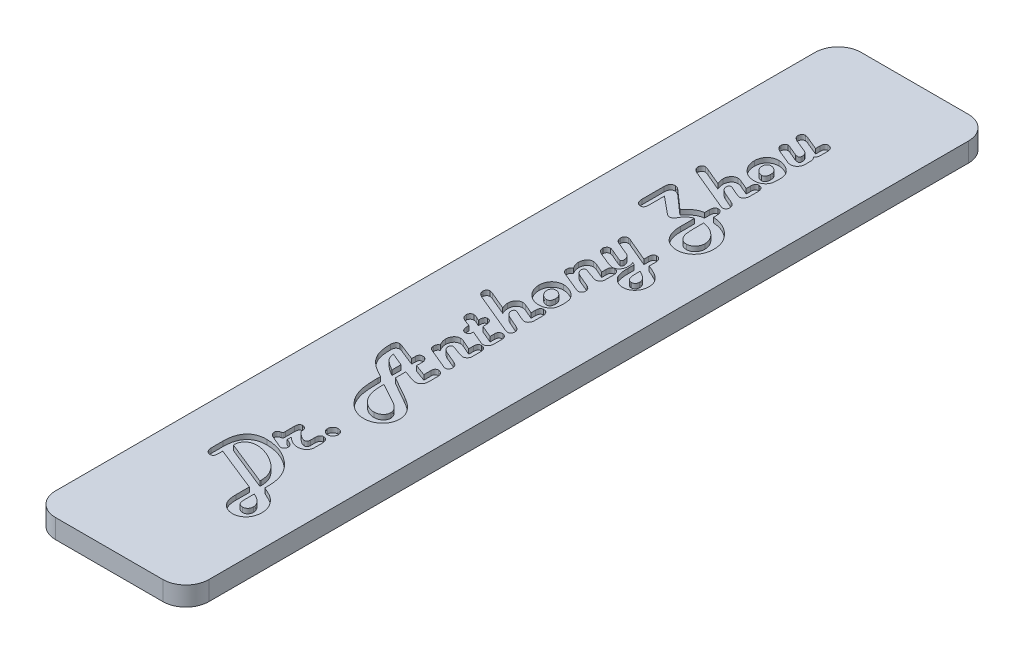
from build123d import *

# Parameters (mm, degrees)
BOSS_EXTRUDE1_DEPTH      = 66.675
BOSS_EXTRUDE1_DEPTH_BACK = 66.675
SKETCH3_W                = 25.4
SKETCH3_H                = 3.175
SKETCH5_OUTSIDE_W        = 54.556
SKETCH5_OUTSIDE_H        = 162.506
CUT_EXTRUDE2_DEPTH       = 68.947967225
CUT_EXTRUDE1_DEPTH       = 0.79375


with BuildPart() as part:
    # Sketch3 → Boss-Extrude1 (new, two sides: drawn at the far end of the back side and taken through both)
    with BuildSketch(Plane.XY.offset(-BOSS_EXTRUDE1_DEPTH_BACK)):
        Rectangle(SKETCH3_W, SKETCH3_H)
    extrude(amount=BOSS_EXTRUDE1_DEPTH + BOSS_EXTRUDE1_DEPTH_BACK)

    # Sketch5 outside → Cut-Extrude2 (cut, through all)
    with BuildSketch(Plane(origin=(0, 1.5875, 0), x_dir=(1, 0, 0), z_dir=(0, 1, 0))):
        Rectangle(SKETCH5_OUTSIDE_W, SKETCH5_OUTSIDE_H)
        with BuildLine():
            Line((12.7, -62.865), (12.7, 62.865))
            ThreePointArc((12.7, 62.865), (11.584076836, 65.559076836), (8.89, 66.675))
            Line((8.89, 66.675), (-8.89, 66.675))
            ThreePointArc((-8.89, 66.675), (-11.584076836, 65.559076836), (-12.7, 62.865))
            Line((-12.7, 62.865), (-12.7, -62.865))
            ThreePointArc((-12.7, -62.865), (-11.584076836, -65.559076836), (-8.89, -66.675))
            Line((-8.89, -66.675), (8.89, -66.675))
            ThreePointArc((8.89, -66.675), (11.584076836, -65.559076836), (12.7, -62.865))
        make_face(mode=Mode.SUBTRACT)
    extrude(amount=-CUT_EXTRUDE2_DEPTH, mode=Mode.SUBTRACT)

    # Sketch4 → Cut-Extrude1 (cut)
    # profile 1 of 14: a face of its own
    with BuildSketch(Plane(origin=(0, 1.5875, 0), x_dir=(1, 0, 0), z_dir=(0, 1, 0))):
        with BuildLine():
            Line((-4.559917059, -43.320587681), (-4.559917059, -43.93813255))
            Line((-4.559917059, -43.93813255), (-4.559917059, -44.106385793))
            add(Edge.make_bspline(
                [(-4.559917059, -44.106385793), (-4.561610976, -44.164422599), (-4.564784094, -44.273139697), (-4.589931776, -44.425357778), (-4.633630966, -44.555586158), (-4.696730762, -44.663229061), (-4.778330966, -44.748635087), (-4.880561638, -44.806687263), (-4.999412501, -44.84282246), (-5.084735728, -44.846096143), (-5.129389573, -44.847809423)],
                knots=[0, 0, 0, 0, 1.305737749, 2.445965353, 3.459324035, 4.379959175, 5.233349143, 6.085046436, 6.997810513, 8, 8, 8, 8], degree=3))
            add(Edge.make_bspline(
                [(-5.129389573, -44.847809423), (-5.187750149, -44.844340303), (-5.30292586, -44.837493929), (-5.468151212, -44.780025485), (-5.614784025, -44.681776686), (-5.743753347, -44.552418449), (-5.848115745, -44.39548662), (-5.924927679, -44.218432086), (-5.972417633, -44.024417631), (-5.977366146, -43.889101313), (-5.979900471, -43.819800599)],
                knots=[0, 0, 0, 0, 0.941902933, 1.858863449, 2.78744378, 3.773831386, 4.79357467, 5.815409039, 6.881186575, 8, 8, 8, 8], degree=3))
            Line((-5.979900471, -43.819800599), (-5.979900471, -43.651547356))
            Line((-5.979900471, -43.651547356), (-5.979900471, -41.822948926))
            add(Edge.make_bspline(
                [(-5.979900471, -41.822948926), (-5.977707958, -41.672471788), (-5.973449094, -41.380176282), (-5.932223436, -40.955601994), (-5.864641858, -40.557948544), (-5.768860295, -40.187336899), (-5.646431541, -39.843280089), (-5.499595387, -39.5244786), (-5.320725089, -39.235040541), (-5.116498909, -38.97241099), (-4.886890635, -38.738364461), (-4.631672363, -38.535356658), (-4.352227407, -38.364051279), (-4.048199831, -38.22544693), (-3.721125372, -38.115761568), (-3.370254227, -38.039298117), (-2.995787646, -37.991892583), (-2.73824612, -37.987050394), (-2.605590931, -37.984556266)],
                knots=[0, 0, 0, 0, 1.240121913, 2.408884614, 3.512215636, 4.562072732, 5.559962685, 6.519078054, 7.449661058, 8.358196616, 9.256317547, 10.145746268, 11.039719344, 11.951275398, 12.894325228, 13.877939151, 14.906963136, 16, 16, 16, 16], degree=3))
            add(Edge.make_bspline(
                [(-2.605590931, -37.984556266), (-2.400089014, -37.989270546), (-1.991841595, -37.998635874), (-1.386269115, -38.08191997), (-0.793366257, -38.212132907), (-0.213871492, -38.396798278), (0.352692077, -38.632127055), (0.904388313, -38.923150288), (1.446049981, -39.262667611), (1.786567834, -39.527233397), (1.959433865, -39.661541884)],
                knots=[0, 0, 0, 0, 0.99369571, 1.974062893, 2.951324249, 3.9272385, 4.912259598, 5.915104549, 6.941589699, 8, 8, 8, 8], degree=3))
            add(Edge.make_bspline(
                [(1.959433865, -39.661541884), (2.054701758, -39.740553817), (2.242940958, -39.896672974), (2.504944901, -40.147196945), (2.74720793, -40.40416119), (2.971378106, -40.667949507), (3.173502412, -40.9410023), (3.357794748, -41.220730658), (3.521002772, -41.508784037), (3.665909126, -41.805617256), (3.792295467, -42.113684618), (3.899260967, -42.435947385), (3.991667445, -42.772190337), (4.067990844, -43.123881776), (4.123513528, -43.49029331), (4.167490004, -43.870667649), (4.190445917, -44.266344166), (4.19455613, -44.535314438), (4.196647314, -44.672160433)],
                knots=[0, 0, 0, 0, 1.041972891, 2.058827374, 3.050103684, 4.014970579, 4.971989252, 5.909071109, 6.834104011, 7.757898592, 8.688895906, 9.635856426, 10.615406742, 11.624176682, 12.664286734, 13.734882699, 14.847559518, 16, 16, 16, 16], degree=3))
            Line((4.196647314, -44.672160433), (4.196647314, -45.112207376))
            Line((4.196647314, -45.112207376), (4.37414524, -45.188013782))
            add(Edge.make_bspline(
                [(4.37414524, -45.188013782), (4.453632101, -45.223795233), (4.606558823, -45.292636045), (4.827635048, -45.391462409), (5.028211554, -45.488450559), (5.211831257, -45.576640887), (5.376564377, -45.659596678), (5.522071299, -45.737710076), (5.650960488, -45.806984895), (5.79667375, -45.896562586), (5.965930053, -46.012447), (6.162989559, -46.163967009), (6.355288843, -46.336288843), (6.477152694, -46.462388236), (6.539250156, -46.526643978)],
                knots=[0, 0, 0, 0, 1.222800361, 2.352575644, 3.396669397, 4.347862466, 5.210067408, 5.983579217, 6.664594993, 7.262130753, 8.381971782, 9.540587582, 10.746771362, 12, 12, 12, 12], degree=3))
            add(Edge.make_bspline(
                [(6.539250156, -46.526643978), (6.616599573, -46.614120053), (6.768871819, -46.786327923), (6.967785047, -47.063239326), (7.133848987, -47.350720248), (7.273051737, -47.646231477), (7.378067162, -47.952835626), (7.454027157, -48.269096497), (7.502020066, -48.594749904), (7.507289485, -48.815463657), (7.509941941, -48.926563859)],
                knots=[0, 0, 0, 0, 1.055914228, 2.078702545, 3.078046045, 4.055880218, 5.029205391, 6.004237832, 6.995397536, 8, 8, 8, 8], degree=3))
            add(Edge.make_bspline(
                [(7.509941941, -48.926563859), (7.50751975, -49.017226928), (7.502761267, -49.195337822), (7.474049325, -49.456096192), (7.421488972, -49.704053782), (7.34938782, -49.939935649), (7.257020998, -50.164312816), (7.143716015, -50.376189996), (7.009899924, -50.575031682), (6.856644242, -50.759373732), (6.687714422, -50.926712163), (6.506578594, -51.073588024), (6.313366011, -51.196821841), (6.110129337, -51.299611284), (5.893455204, -51.376397816), (5.667279026, -51.434808761), (5.429033505, -51.468162943), (5.266665876, -51.472294611), (5.18397953, -51.474398678)],
                knots=[0, 0, 0, 0, 1.126201464, 2.212463691, 3.25287726, 4.269850786, 5.272053028, 6.261782411, 7.249022054, 8.243830034, 9.23438794, 10.19795826, 11.134388982, 12.075812372, 13.02018767, 13.98375799, 14.973220915, 16, 16, 16, 16], degree=3))
            add(Edge.make_bspline(
                [(5.18397953, -51.474398678), (5.081335973, -51.47133909), (4.877982169, -51.465277542), (4.579825368, -51.401570583), (4.289799519, -51.308611218), (4.014614143, -51.172966788), (3.758034565, -51.006100892), (3.529437008, -50.808867269), (3.328764657, -50.584577285), (3.222399841, -50.415410836), (3.16863849, -50.32990684)],
                knots=[0, 0, 0, 0, 1.014242392, 2.009381349, 3.004557683, 4.021967388, 5.035219112, 6.025505851, 7.00200576, 8, 8, 8, 8], degree=3))
            add(Edge.make_bspline(
                [(3.16863849, -50.32990684), (3.136714334, -50.270660935), (3.071597788, -50.149815494), (2.992995572, -49.954322371), (2.926950272, -49.744517352), (2.870788224, -49.51994236), (2.829764581, -49.279985783), (2.797718832, -49.025277653), (2.779309079, -48.75550394), (2.777560544, -48.570362897), (2.776663902, -48.475423296)],
                knots=[0, 0, 0, 0, 0.84245226, 1.718372183, 2.633912599, 3.596293803, 4.615457363, 5.681185209, 6.810920853, 8, 8, 8, 8], degree=3))
            Line((2.776663902, -48.475423296), (2.776663902, -46.260397088))
            Line((2.776663902, -46.260397088), (-4.559917059, -43.320587681))
        make_face()
        with BuildLine():
            Line((2.776663902, -44.505756127), (2.776663902, -44.256149668))
            add(Edge.make_bspline(
                [(2.776663902, -44.256149668), (2.775158588, -44.175982387), (2.772177891, -44.017241806), (2.750907252, -43.781477523), (2.718631965, -43.550306086), (2.66989146, -43.324493097), (2.608881362, -43.104070143), (2.534965838, -42.888211402), (2.445246426, -42.677653552), (2.344938658, -42.470256485), (2.226541299, -42.270240602), (2.097812551, -42.07396878), (1.954133557, -41.883465648), (1.800101596, -41.695782063), (1.627361835, -41.517156365), (1.446095421, -41.338597946), (1.246828953, -41.168971579), (1.107489343, -41.060657324), (1.036814435, -41.00571889)],
                knots=[0, 0, 0, 0, 1.003752549, 1.98754731, 2.96218803, 3.924869515, 4.877913061, 5.824875223, 6.779479857, 7.742439712, 8.707376773, 9.687714611, 10.680189018, 11.694008127, 12.725763052, 13.790025714, 14.879071578, 16, 16, 16, 16], degree=3))
            add(Edge.make_bspline(
                [(1.036814435, -41.00571889), (0.896572449, -40.903629009), (0.616806194, -40.699971715), (0.170936502, -40.435215923), (-0.290650587, -40.200559095), (-0.765173394, -40.003593984), (-1.238073643, -39.843184437), (-1.699086717, -39.727239587), (-2.142266548, -39.654615477), (-2.432770652, -39.645594224), (-2.574159007, -39.64120358)],
                knots=[0, 0, 0, 0, 1.061151743, 2.116872814, 3.169496409, 4.227969904, 5.258553914, 6.222792805, 7.135033211, 8, 8, 8, 8], degree=3))
            add(Edge.make_bspline(
                [(-2.574159007, -39.64120358), (-2.64880388, -39.642407139), (-2.794805096, -39.644761233), (-3.008167817, -39.669501335), (-3.209600257, -39.708989482), (-3.397990688, -39.767461872), (-3.574956886, -39.839259799), (-3.740258813, -39.927982216), (-3.892164201, -40.034216837), (-4.031879319, -40.154262488), (-4.15496244, -40.290118197), (-4.265911753, -40.435940196), (-4.355664835, -40.596051735), (-4.430288406, -40.766401553), (-4.49057717, -40.948043925), (-4.528920384, -41.142554097), (-4.557152152, -41.347567892), (-4.558978912, -41.488184959), (-4.559917059, -41.56039991)],
                knots=[0, 0, 0, 0, 1.145531499, 2.240595844, 3.292755274, 4.292422607, 5.264114043, 6.220902991, 7.165828125, 8.104908158, 9.042461542, 9.975419986, 10.911970153, 11.852526766, 12.827988561, 13.843075609, 14.892295267, 16, 16, 16, 16], degree=3))
            Line((-4.559917059, -41.56039991), (2.776663902, -44.505756127))
        make_face(mode=Mode.SUBTRACT)
        with BuildLine():
            Line((4.196647314, -46.8649994), (4.196647314, -48.519797777))
            add(Edge.make_bspline(
                [(4.196647314, -48.519797777), (4.199399964, -48.612415259), (4.204550665, -48.785719117), (4.244181689, -49.028244405), (4.312132698, -49.235372095), (4.414386414, -49.404368899), (4.542633509, -49.539850404), (4.703583085, -49.633599673), (4.89180596, -49.690420102), (5.026391725, -49.69632042), (5.097079503, -49.699419414)],
                knots=[0, 0, 0, 0, 1.31364871, 2.458071474, 3.475829816, 4.38621616, 5.23967168, 6.094559773, 6.99921559, 8, 8, 8, 8], degree=3))
            add(Edge.make_bspline(
                [(5.097079503, -49.699419414), (5.156654517, -49.696474239), (5.273103212, -49.690717435), (5.439004263, -49.637905811), (5.591397973, -49.55560745), (5.721772708, -49.437902596), (5.833919609, -49.300722631), (5.914285086, -49.143206524), (5.961882451, -48.970585223), (5.968322738, -48.851058993), (5.971626579, -48.78974254)],
                knots=[0, 0, 0, 0, 1.015443884, 1.984844108, 2.946375274, 3.953924431, 4.965428653, 5.959234333, 6.953095811, 8, 8, 8, 8], degree=3))
            add(Edge.make_bspline(
                [(5.971626579, -48.78974254), (5.970194428, -48.742821498), (5.967332973, -48.649072666), (5.944419296, -48.509528491), (5.906267343, -48.372010346), (5.857683841, -48.234682863), (5.789637581, -48.10097373), (5.707043617, -47.969788418), (5.613830685, -47.837360407), (5.46202164, -47.666375065), (5.244443232, -47.458605823), (4.938113528, -47.235239258), (4.586699247, -47.032229101), (4.329834993, -46.922101888), (4.196647314, -46.8649994)],
                knots=[0, 0, 0, 0, 0.609246736, 1.21728261, 1.830931323, 2.461525313, 3.105941494, 3.774613737, 4.474427454, 5.206422339, 6.740961797, 8.372497183, 10.119089455, 12, 12, 12, 12], degree=3))
        make_face(mode=Mode.SUBTRACT)
    # profile 2 of 14: a face of its own
    with BuildSketch(Plane(origin=(0, 1.5875, 0), x_dir=(1, 0, 0), z_dir=(0, 1, 0))):
        with BuildLine():
            Line((-0.891626579, -36.311268522), (-0.385017913, -36.531291993))
            add(Edge.make_bspline(
                [(-0.385017913, -36.531291993), (-0.331446427, -36.556099658), (-0.229396847, -36.603356361), (-0.092210598, -36.687772479), (0.026721265, -36.77415287), (0.123595731, -36.86852213), (0.199530521, -36.969224451), (0.25193315, -37.076676435), (0.28511247, -37.189411402), (0.289488726, -37.266944892), (0.291692931, -37.305996485)],
                knots=[0, 0, 0, 0, 1.297501196, 2.471640463, 3.537215363, 4.524637192, 5.43567625, 6.296618738, 7.14205136, 8, 8, 8, 8], degree=3))
            add(Edge.make_bspline(
                [(0.291692931, -37.305996485), (0.290388934, -37.352442459), (0.287852121, -37.44279905), (0.254626602, -37.571245605), (0.204996841, -37.689463802), (0.132631636, -37.79091817), (0.048513382, -37.877553252), (-0.049302817, -37.940304471), (-0.158234458, -37.976619408), (-0.233758394, -37.98187758), (-0.272232773, -37.984556266)],
                knots=[0, 0, 0, 0, 1.131994738, 2.202197021, 3.220602635, 4.248319073, 5.22801886, 6.155513921, 7.060358075, 8, 8, 8, 8], degree=3))
            add(Edge.make_bspline(
                [(-0.272232773, -37.984556266), (-0.299457233, -37.98214457), (-0.36276573, -37.976536348), (-0.468027333, -37.948372974), (-0.596290243, -37.902486329), (-0.689010043, -37.864779187), (-0.740013766, -37.844037074)],
                knots=[0, 0, 0, 0, 0.667539348, 1.552314029, 2.65356594, 4, 4, 4, 4], degree=3))
            Line((-0.740013766, -37.844037074), (-2.415150447, -37.124800685))
            add(Edge.make_bspline(
                [(-2.415150447, -37.124800685), (-2.463187112, -37.10310889), (-2.554913723, -37.061688136), (-2.678297348, -36.984252018), (-2.78417832, -36.902235866), (-2.871052458, -36.812173714), (-2.938993203, -36.715823585), (-2.985289856, -36.611321844), (-3.017200328, -36.501123374), (-3.020118402, -36.424284294), (-3.021601696, -36.385225991)],
                knots=[0, 0, 0, 0, 1.242093141, 2.371792344, 3.427691145, 4.394328043, 5.313892613, 6.192305435, 7.081125362, 8, 8, 8, 8], degree=3))
            add(Edge.make_bspline(
                [(-3.021601696, -36.385225991), (-3.020007661, -36.347559837), (-3.016981595, -36.276055626), (-2.998938403, -36.173501782), (-2.965972689, -36.0825852), (-2.918742007, -36.003091041), (-2.858441918, -35.934521758), (-2.783273772, -35.879829303), (-2.696413507, -35.833588941), (-2.631929593, -35.814595941), (-2.598195184, -35.804659857)],
                knots=[0, 0, 0, 0, 1.15314347, 2.189090296, 3.173792814, 4.095790583, 5.004376053, 5.947550008, 6.926271946, 8, 8, 8, 8], degree=3))
            Line((-2.598195184, -35.804659857), (-2.411452574, -35.752889628))
            add(Edge.make_bspline(
                [(-2.411452574, -35.752889628), (-2.38898613, -35.746899228), (-2.347836005, -35.735927055), (-2.294471696, -35.709602014), (-2.254236379, -35.678767528), (-2.225673985, -35.637165843), (-2.21053857, -35.578689078), (-2.200786896, -35.4974574), (-2.193471021, -35.389373041), (-2.193346716, -35.307922004), (-2.193278039, -35.262921393)],
                knots=[0, 0, 0, 0, 0.926850573, 1.697643703, 2.362895762, 2.92973869, 3.677374781, 4.746381598, 6.202419277, 8, 8, 8, 8], degree=3))
            Line((-2.193278039, -35.262921393), (-2.193278039, -33.802261373))
            add(Edge.make_bspline(
                [(-2.193278039, -33.802261373), (-2.191652399, -33.74052096), (-2.18861207, -33.625051957), (-2.162713919, -33.463418702), (-2.121684871, -33.325564177), (-2.062947033, -33.210479306), (-1.982696676, -33.122352999), (-1.885266163, -33.059515731), (-1.77070389, -33.021429185), (-1.688820543, -33.016954656), (-1.645992766, -33.014614325)],
                knots=[0, 0, 0, 0, 1.361355543, 2.546053047, 3.599677592, 4.524244374, 5.371169927, 6.197098625, 7.057021238, 8, 8, 8, 8], degree=3))
            add(Edge.make_bspline(
                [(-1.645992766, -33.014614325), (-1.586404528, -33.016712587), (-1.473015207, -33.020705329), (-1.315759926, -33.070943475), (-1.180259011, -33.14954194), (-1.073593992, -33.265613748), (-0.988349091, -33.410139778), (-0.931477425, -33.586760847), (-0.89626264, -33.793455763), (-0.893241288, -33.941380257), (-0.891626579, -34.020435908)],
                knots=[0, 0, 0, 0, 0.994284648, 1.892005291, 2.734571892, 3.588753721, 4.500369607, 5.525254763, 6.677415825, 8, 8, 8, 8], degree=3))
            Line((-0.891626579, -34.020435908), (-0.830611666, -34.085148694))
            add(Edge.make_bspline(
                [(-0.830611666, -34.085148694), (-0.756039107, -34.15913025), (-0.613296102, -34.300741988), (-0.40019657, -34.492524063), (-0.199280461, -34.654398036), (-0.013921537, -34.789283508), (0.161169353, -34.89200575), (0.321540626, -34.96698721), (0.470017153, -35.016360872), (0.566255423, -35.023089862), (0.611558986, -35.026257491)],
                knots=[0, 0, 0, 0, 1.435762249, 2.748263184, 3.91660617, 4.961556361, 5.879059361, 6.685751502, 7.381325737, 8, 8, 8, 8], degree=3))
            add(Edge.make_bspline(
                [(0.611558986, -35.026257491), (0.651238667, -35.025473298), (0.726636922, -35.023983195), (0.830804321, -34.9958136), (0.923009353, -34.959693692), (0.994854774, -34.898877696), (1.052821798, -34.824421827), (1.092233402, -34.732819398), (1.11720581, -34.625740835), (1.119037036, -34.549394232), (1.120016588, -34.508555206)],
                knots=[0, 0, 0, 0, 1.140484469, 2.167117703, 3.098941929, 3.971150526, 4.846255631, 5.80154673, 6.824011975, 8, 8, 8, 8], degree=3))
            Line((1.120016588, -34.508555206), (1.120016588, -33.720908157))
            add(Edge.make_bspline(
                [(1.120016588, -33.720908157), (1.121759902, -33.656124433), (1.125013743, -33.535207594), (1.149367374, -33.365445239), (1.195476734, -33.221890429), (1.257353116, -33.102247785), (1.339906691, -33.009205276), (1.440956323, -32.942495421), (1.561552827, -32.902610145), (1.647882478, -32.898460201), (1.693186976, -32.896282374)],
                knots=[0, 0, 0, 0, 1.364190584, 2.546219988, 3.596843527, 4.525897283, 5.362221888, 6.186477391, 7.048290713, 8, 8, 8, 8], degree=3))
            add(Edge.make_bspline(
                [(1.693186976, -32.896282374), (1.757087809, -32.899629459), (1.879964885, -32.906065682), (2.052581414, -32.96107987), (2.202493549, -33.052414124), (2.324928569, -33.181892297), (2.424704968, -33.341039527), (2.490759532, -33.531970098), (2.534803762, -33.748475742), (2.538209088, -33.902469539), (2.54, -33.983457173)],
                knots=[0, 0, 0, 0, 0.982615473, 1.889504555, 2.759142238, 3.658944971, 4.610088785, 5.631441668, 6.75433984, 8, 8, 8, 8], degree=3))
            Line((2.54, -33.983457173), (2.54, -35.207453291))
            add(Edge.make_bspline(
                [(2.54, -35.207453291), (2.538533574, -35.256222409), (2.535661876, -35.351726782), (2.51441753, -35.491619284), (2.482096406, -35.625347597), (2.433336556, -35.751631733), (2.371490889, -35.870942564), (2.297748169, -35.984716206), (2.208041742, -36.089945439), (2.106546659, -36.187915973), (1.994018354, -36.2758572), (1.873890678, -36.354275558), (1.744650169, -36.419175986), (1.608049179, -36.473037577), (1.462286352, -36.51353483), (1.308898747, -36.542573337), (1.147631673, -36.562064155), (1.037489364, -36.56372584), (0.981346333, -36.564572854)],
                knots=[0, 0, 0, 0, 1.009407673, 1.976719137, 2.923785669, 3.852797958, 4.771676065, 5.702527031, 6.65345443, 7.628144937, 8.618662201, 9.606215811, 10.593522047, 11.607757909, 12.641947342, 13.720607507, 14.838121302, 16, 16, 16, 16], degree=3))
            add(Edge.make_bspline(
                [(0.981346333, -36.564572854), (0.908465042, -36.561950586), (0.762400563, -36.556695188), (0.545408027, -36.518102609), (0.331143351, -36.457375337), (0.1168436, -36.36730775), (-0.106277266, -36.244391323), (-0.348235332, -36.085661711), (-0.614023199, -35.88893563), (-0.79551104, -35.740763398), (-0.891626579, -35.662291728)],
                knots=[0, 0, 0, 0, 0.822710096, 1.64882809, 2.481516469, 3.333299355, 4.267584386, 5.354441073, 6.598918144, 8, 8, 8, 8], degree=3))
            Line((-0.891626579, -35.662291728), (-0.891626579, -36.311268522))
        make_face()
    # profile 3 of 14: a face of its own
    with BuildSketch(Plane(origin=(0, 1.5875, 0), x_dir=(1, 0, 0), z_dir=(0, 1, 0))):
        with BuildLine():
            add(Edge.make_bspline(
                [(0.883352686, -31.413435113), (0.886467905, -31.354523636), (0.892547409, -31.239554958), (0.943170479, -31.073859037), (1.025915348, -30.921456971), (1.140733772, -30.78702444), (1.275166303, -30.672206016), (1.427568369, -30.589461147), (1.593264291, -30.538838076), (1.708232969, -30.532758572), (1.767144445, -30.529643354)],
                knots=[0, 0, 0, 0, 1.018015329, 1.986707578, 2.970091954, 4, 5.029908046, 6.013292422, 6.981984671, 8, 8, 8, 8], degree=3))
            add(Edge.make_bspline(
                [(1.767144445, -30.529643354), (1.826652363, -30.532828174), (1.943384095, -30.539075571), (2.111659492, -30.589078455), (2.26622085, -30.671667419), (2.400918925, -30.787074695), (2.515777419, -30.92144418), (2.598512072, -31.07386232), (2.649137778, -31.239554094), (2.655216919, -31.354523344), (2.658331951, -31.413435113)],
                knots=[0, 0, 0, 0, 1.023458974, 2.007634331, 2.995409192, 4.02013336, 5.044857529, 6.023292197, 6.987108688, 8, 8, 8, 8], degree=3))
            add(Edge.make_bspline(
                [(2.658331951, -31.413435113), (2.65514732, -31.472943328), (2.648900293, -31.589675643), (2.598894708, -31.757946788), (2.516316091, -31.912524433), (2.4008687, -32.047159368), (2.266233765, -32.162606759), (2.11165612, -32.245185376), (1.943384976, -32.295190961), (1.82665266, -32.301437987), (1.767144445, -32.304622619)],
                knots=[0, 0, 0, 0, 1.018333356, 1.997579833, 2.980407786, 4, 5.019592214, 6.002420167, 6.981666644, 8, 8, 8, 8], degree=3))
            add(Edge.make_bspline(
                [(1.767144445, -32.304622619), (1.708232676, -32.301507586), (1.593263426, -32.295428446), (1.427571652, -32.24480274), (1.275153512, -32.162068086), (1.140784028, -32.047209593), (1.025376751, -31.912511518), (0.942787787, -31.75795016), (0.892784904, -31.589674762), (0.886537507, -31.472943031), (0.883352686, -31.413435113)],
                knots=[0, 0, 0, 0, 1.012891312, 1.976707803, 2.955142471, 3.97986664, 5.004590808, 5.992365669, 6.976541026, 8, 8, 8, 8], degree=3))
        make_face()
    # profile 4 of 14: a face of its own
    with BuildSketch(Plane(origin=(0, 1.5875, 0), x_dir=(1, 0, 0), z_dir=(0, 1, 0))):
        with BuildLine():
            Line((-0.773294628, -16.795741293), (-0.773294628, -18.524497139))
            Line((-0.773294628, -18.524497139), (2.893146916, -20.597155218))
            add(Edge.make_bspline(
                [(2.893146916, -20.597155218), (2.999195989, -20.657701372), (3.206665055, -20.776150818), (3.500580504, -20.968631784), (3.776439225, -21.161036484), (4.030343795, -21.360308958), (4.266156087, -21.561170313), (4.480795454, -21.767725176), (4.67334, -21.980030074), (4.84900978, -22.193501676), (4.999826787, -22.415155009), (5.134614601, -22.638003358), (5.245328913, -22.867652376), (5.339151328, -23.099903272), (5.408354333, -23.338157292), (5.461612845, -23.578762281), (5.491003172, -23.824673876), (5.495853837, -23.989883669), (5.498298775, -24.073156278)],
                knots=[0, 0, 0, 0, 1.284127512, 2.512202389, 3.693820525, 4.820683154, 5.905595552, 6.95085666, 7.951169987, 8.919030195, 9.855848477, 10.768583501, 11.655730142, 12.534476643, 13.400021201, 14.262063092, 15.124007484, 16, 16, 16, 16], degree=3))
            add(Edge.make_bspline(
                [(5.498298775, -24.073156278), (5.495271637, -24.174365592), (5.489339988, -24.372684341), (5.448002691, -24.664688746), (5.378209002, -24.94369309), (5.278864896, -25.210529671), (5.15360832, -25.464755813), (4.997156545, -25.705024412), (4.816765592, -25.934939393), (4.607562389, -26.147545267), (4.380165801, -26.342995299), (4.135808964, -26.514048), (3.876869973, -26.655690419), (3.607204401, -26.777144686), (3.321594088, -26.865342064), (3.024615738, -26.933447511), (2.713607491, -26.97245874), (2.501894141, -26.977244431), (2.393933998, -26.979684824)],
                knots=[0, 0, 0, 0, 1.023509052, 2.005556865, 2.976162568, 3.926806602, 4.88020563, 5.83639235, 6.821600422, 7.8310613, 8.847943164, 9.850897116, 10.841415261, 11.829399931, 12.83678008, 13.859073563, 14.908265711, 16, 16, 16, 16], degree=3))
            add(Edge.make_bspline(
                [(2.393933998, -26.979684824), (2.30507792, -26.978253285), (2.127414996, -26.975390999), (1.862543186, -26.941374538), (1.599588719, -26.892749354), (1.339084567, -26.821052014), (1.080931777, -26.731496331), (0.825881007, -26.618541358), (0.572790177, -26.487920517), (0.324397042, -26.336338063), (0.082652853, -26.16807108), (-0.151259328, -25.985407359), (-0.37229027, -25.785125009), (-0.584052373, -25.571624783), (-0.785822172, -25.344266204), (-0.976320892, -25.101459323), (-1.156368355, -24.843892385), (-1.266655481, -24.663563437), (-1.322428838, -24.572369197)],
                knots=[0, 0, 0, 0, 0.920360802, 1.840211654, 2.763493683, 3.690106123, 4.637553702, 5.592892168, 6.578521632, 7.587450506, 8.606298991, 9.629842057, 10.661069622, 11.695398393, 12.745173504, 13.809615302, 14.892299487, 16, 16, 16, 16], degree=3))
            add(Edge.make_bspline(
                [(-1.322428838, -24.572369197), (-1.398939321, -24.430633351), (-1.55280402, -24.145598645), (-1.738512285, -23.691967956), (-1.887837835, -23.216546822), (-1.985178878, -22.802791207), (-2.046498135, -22.453087018), (-2.083673758, -22.167227205), (-2.120718529, -21.861205712), (-2.143942962, -21.533451671), (-2.167857199, -21.185372486), (-2.181267315, -20.816026192), (-2.190957385, -20.425872208), (-2.192491558, -20.158964182), (-2.193278039, -20.022135894)],
                knots=[0, 0, 0, 0, 1.235982978, 2.485595966, 3.756177378, 5.05891948, 5.745857238, 6.481327979, 7.271967052, 8.112145328, 9.003570026, 9.950725021, 10.949455392, 12, 12, 12, 12], degree=3))
            Line((-2.193278039, -20.022135894), (-2.193278039, -19.55990171))
            Line((-2.193278039, -19.55990171), (-3.088163419, -19.069933476))
            add(Edge.make_bspline(
                [(-3.088163419, -19.069933476), (-3.238595051, -18.984505717), (-3.532227058, -18.817756717), (-3.940686936, -18.538638917), (-4.313774302, -18.249121338), (-4.643957533, -17.941105409), (-4.94036746, -17.623256573), (-5.190951646, -17.285999478), (-5.410099191, -16.938455915), (-5.522752335, -16.692353423), (-5.5786812, -16.570171011)],
                knots=[0, 0, 0, 0, 1.154231185, 2.252978409, 3.298924017, 4.303170672, 5.263936639, 6.195269199, 7.104005978, 8, 8, 8, 8], degree=3))
            add(Edge.make_bspline(
                [(-5.5786812, -16.570171011), (-5.61128345, -16.488623902), (-5.678129748, -16.321423098), (-5.758288789, -16.055907688), (-5.825973089, -15.772322863), (-5.884020749, -15.471485855), (-5.925318306, -15.15149967), (-5.956142147, -14.814140653), (-5.977951532, -14.458351214), (-5.97924025, -14.215276238), (-5.979900471, -14.090746851)],
                knots=[0, 0, 0, 0, 0.833580457, 1.709138717, 2.630308376, 3.601286859, 4.616795241, 5.692327562, 6.817759698, 8, 8, 8, 8], degree=3))
            add(Edge.make_bspline(
                [(-5.979900471, -14.090746851), (-5.977801509, -14.028985377), (-5.973804111, -13.911362879), (-5.943182161, -13.745042691), (-5.889365577, -13.599424196), (-5.813458994, -13.475312311), (-5.716552885, -13.37633039), (-5.602252714, -13.302365082), (-5.468502912, -13.261797607), (-5.374324229, -13.256126136), (-5.325376867, -13.25317851)],
                knots=[0, 0, 0, 0, 1.235229773, 2.35245055, 3.366973227, 4.325000809, 5.240507286, 6.116206508, 7.020938506, 8, 8, 8, 8], degree=3))
            add(Edge.make_bspline(
                [(-5.325376867, -13.25317851), (-5.27381838, -13.257397865), (-5.15982109, -13.26672698), (-5.051757204, -13.304563277), (-4.992568255, -13.325287043)],
                knots=[0, 0, 0, 0, 0.904556353, 2, 2, 2, 2], degree=3))
            Line((-4.992568255, -13.325287043), (-4.852049063, -13.380755145))
            Line((-4.852049063, -13.380755145), (-2.193278039, -14.418008653))
            Line((-2.193278039, -14.418008653), (-2.193278039, -13.944680849))
            Line((-2.193278039, -13.944680849), (-2.193278039, -13.781974416))
            add(Edge.make_bspline(
                [(-2.193278039, -13.781974416), (-2.191790547, -13.731281022), (-2.188989116, -13.635808865), (-2.16097094, -13.502810791), (-2.116893618, -13.388595754), (-2.053851911, -13.293461205), (-1.969104045, -13.220570003), (-1.866269894, -13.171268343), (-1.747244597, -13.138116635), (-1.661653285, -13.135977372), (-1.616409778, -13.134846559)],
                knots=[0, 0, 0, 0, 1.224457869, 2.306052593, 3.269225765, 4.170438305, 5.03696607, 5.936821825, 6.909405468, 8, 8, 8, 8], degree=3))
            add(Edge.make_bspline(
                [(-1.616409778, -13.134846559), (-1.559879515, -13.137712467), (-1.448611879, -13.143353389), (-1.289659985, -13.198491349), (-1.144272661, -13.285373597), (-1.016735879, -13.404489614), (-0.906950268, -13.544937982), (-0.829221911, -13.706438793), (-0.780469059, -13.882689057), (-0.775733879, -14.005365048), (-0.773294628, -14.06855961)],
                knots=[0, 0, 0, 0, 0.967844388, 1.904993043, 2.854314898, 3.858179587, 4.884883616, 5.897857367, 6.917115065, 8, 8, 8, 8], degree=3))
            Line((-0.773294628, -14.06855961), (-0.773294628, -14.236812853))
            Line((-0.773294628, -14.236812853), (-0.773294628, -15.024459902))
            Line((-0.773294628, -15.024459902), (1.120016588, -15.71596224))
            Line((1.120016588, -15.71596224), (1.120016588, -14.699047036))
            Line((1.120016588, -14.699047036), (1.120016588, -14.536340604))
            add(Edge.make_bspline(
                [(1.120016588, -14.536340604), (1.121740501, -14.482006882), (1.124975861, -14.380035898), (1.149821485, -14.237397425), (1.19425233, -14.116041224), (1.256750157, -14.015487348), (1.340561786, -13.93874557), (1.440330451, -13.881390525), (1.560221316, -13.851040281), (1.644962614, -13.846974559), (1.689489102, -13.844838265)],
                knots=[0, 0, 0, 0, 1.273098158, 2.389290989, 3.376549181, 4.286045457, 5.134299476, 6.013945099, 6.956446832, 8, 8, 8, 8], degree=3))
            add(Edge.make_bspline(
                [(1.689489102, -13.844838265), (1.747282205, -13.848281772), (1.860566737, -13.855031645), (2.022210833, -13.912161155), (2.17013105, -14.002473527), (2.296607878, -14.129869518), (2.406588749, -14.277372231), (2.484492623, -14.446781819), (2.532582398, -14.631067833), (2.537486778, -14.759143218), (2.54, -14.824774734)],
                knots=[0, 0, 0, 0, 0.959970407, 1.881708946, 2.821665646, 3.823251842, 4.851715016, 5.871022397, 6.909017313, 8, 8, 8, 8], degree=3))
            Line((2.54, -14.824774734), (2.54, -14.993027977))
            Line((2.54, -14.993027977), (2.54, -16.327960299))
            add(Edge.make_bspline(
                [(2.54, -16.327960299), (2.536579667, -16.411459613), (2.529990921, -16.5723082), (2.475855413, -16.802047525), (2.384011259, -17.007130394), (2.258413407, -17.185597756), (2.102930863, -17.330881317), (1.922762281, -17.437289357), (1.720408624, -17.502897566), (1.577818215, -17.509657431), (1.504595429, -17.513128746)],
                knots=[0, 0, 0, 0, 1.135640793, 2.187637353, 3.190204587, 4.177136149, 5.13878535, 6.063917208, 7.005786023, 8, 8, 8, 8], degree=3))
            add(Edge.make_bspline(
                [(1.504595429, -17.513128746), (1.439076592, -17.509787956), (1.293779192, -17.502379277), (1.059448779, -17.451626788), (0.788310171, -17.372746378), (0.59762858, -17.304125777), (0.495075972, -17.26722016)],
                knots=[0, 0, 0, 0, 0.753316793, 1.670587834, 2.747192678, 4, 4, 4, 4], degree=3))
            Line((0.495075972, -17.26722016), (-0.773294628, -16.795741293))
        make_face()
        with BuildLine():
            Line((-2.193278039, -16.183743234), (-4.345440398, -15.285159981))
            add(Edge.make_bspline(
                [(-4.345440398, -15.285159981), (-4.335276961, -15.391741138), (-4.315484514, -15.599299083), (-4.229812596, -15.894061401), (-4.106586546, -16.163111305), (-3.969436306, -16.36781564), (-3.832205331, -16.519613459), (-3.712903875, -16.639895778), (-3.572357661, -16.761445989), (-3.415642304, -16.889151066), (-3.239620759, -17.020230952), (-3.044611312, -17.154697666), (-2.833074559, -17.295849417), (-2.682994994, -17.386744835), (-2.605590931, -17.433624466)],
                knots=[0, 0, 0, 0, 1.327479438, 2.585155888, 3.790872231, 4.992669277, 5.627155637, 6.330882107, 7.09570796, 7.933840435, 8.841788147, 9.820799051, 10.876069462, 12, 12, 12, 12], degree=3))
            Line((-2.605590931, -17.433624466), (-2.193278039, -17.688777735))
            Line((-2.193278039, -17.688777735), (-2.193278039, -16.183743234))
        make_face(mode=Mode.SUBTRACT)
        with BuildLine():
            Line((-0.773294628, -20.415959418), (-0.773294628, -20.944755324))
            add(Edge.make_bspline(
                [(-0.773294628, -20.944755324), (-0.77110857, -21.088413999), (-0.766843605, -21.368689872), (-0.735325629, -21.778050109), (-0.682776548, -22.164842849), (-0.606416011, -22.528474264), (-0.511649137, -22.869707031), (-0.392578251, -23.187464067), (-0.253205307, -23.483347936), (-0.14081072, -23.665489284), (-0.085490162, -23.75513916)],
                knots=[0, 0, 0, 0, 1.17507216, 2.292547767, 3.356328211, 4.36586142, 5.329840842, 6.250349605, 7.138822986, 8, 8, 8, 8], degree=3))
            add(Edge.make_bspline(
                [(-0.085490162, -23.75513916), (-0.010329347, -23.861898789), (0.138715782, -24.073604884), (0.404657823, -24.354146048), (0.69436242, -24.604537996), (1.008394965, -24.817152135), (1.337156275, -24.990071928), (1.67380925, -25.11194108), (2.011849229, -25.191164177), (2.238819248, -25.200215581), (2.351408453, -25.20470556)],
                knots=[0, 0, 0, 0, 1.061931571, 2.105827722, 3.137883091, 4.174868311, 5.187188109, 6.15404082, 7.084306037, 8, 8, 8, 8], degree=3))
            add(Edge.make_bspline(
                [(2.351408453, -25.20470556), (2.450431984, -25.200129509), (2.64431031, -25.191170053), (2.92387659, -25.11951425), (3.179719549, -24.998739538), (3.371056088, -24.861153965), (3.506668077, -24.732783875), (3.597045467, -24.630823487), (3.67097916, -24.521830575), (3.734433281, -24.409925274), (3.78336066, -24.292058437), (3.816131806, -24.168866715), (3.837106727, -24.041203012), (3.840127684, -23.954289309), (3.841651461, -23.910449846)],
                knots=[0, 0, 0, 0, 1.625345399, 3.182266278, 4.704124598, 6.249545861, 7.030225429, 7.76935358, 8.482720177, 9.189807842, 9.879872433, 10.572531956, 11.279981989, 12, 12, 12, 12], degree=3))
            add(Edge.make_bspline(
                [(3.841651461, -23.910449846), (3.837766744, -23.833009975), (3.829999283, -23.678169589), (3.765620857, -23.450829355), (3.661381502, -23.232274075), (3.519246312, -23.018945293), (3.333248208, -22.816152794), (3.108572988, -22.618985349), (2.843732789, -22.428936736), (2.647666508, -22.314996443), (2.54554681, -22.255651469)],
                knots=[0, 0, 0, 0, 0.841394824, 1.682362055, 2.549233927, 3.467926034, 4.460234473, 5.5338279, 6.715512172, 8, 8, 8, 8], degree=3))
            Line((2.54554681, -22.255651469), (-0.773294628, -20.415959418))
        make_face(mode=Mode.SUBTRACT)
    # profile 5 of 14: a face of its own
    with BuildSketch(Plane(origin=(0, 1.5875, 0), x_dir=(1, 0, 0), z_dir=(0, 1, 0))):
        with BuildLine():
            Line((1.120016588, -8.279538695), (1.120016588, -7.530719318))
            add(Edge.make_bspline(
                [(1.120016588, -7.530719318), (1.121440944, -7.468941418), (1.124107186, -7.353299724), (1.152429525, -7.192418668), (1.194800746, -7.054042607), (1.260091608, -6.940984666), (1.343844126, -6.851758104), (1.446928025, -6.789867472), (1.567905252, -6.751359232), (1.654661679, -6.747149474), (1.700582723, -6.744921206)],
                knots=[0, 0, 0, 0, 1.332558988, 2.494409445, 3.51712345, 4.441593639, 5.28878003, 6.131038744, 7.010740127, 8, 8, 8, 8], degree=3))
            add(Edge.make_bspline(
                [(1.700582723, -6.744921206), (1.763271176, -6.747515204), (1.88441734, -6.752528134), (2.054120299, -6.808161529), (2.201985306, -6.897712447), (2.325061183, -7.022718791), (2.423233605, -7.177156911), (2.491399178, -7.360454932), (2.534455991, -7.568158495), (2.538096979, -7.715997748), (2.54, -7.793268334)],
                knots=[0, 0, 0, 0, 0.988786751, 1.910841876, 2.790517751, 3.700688286, 4.660983863, 5.664234098, 6.779174028, 8, 8, 8, 8], degree=3))
            Line((2.54, -7.793268334), (2.54, -9.096768732))
            add(Edge.make_bspline(
                [(2.54, -9.096768732), (2.536958177, -9.154284598), (2.531055149, -9.265901158), (2.490833566, -9.427385105), (2.415490821, -9.571302954), (2.319250282, -9.700851082), (2.198759881, -9.806671359), (2.061407121, -9.883518144), (1.909103034, -9.932864796), (1.80204744, -9.937494783), (1.746806141, -9.939883883)],
                knots=[0, 0, 0, 0, 1.068903624, 2.074337967, 3.062738177, 4.06817252, 5.058163504, 6.016931881, 6.976725497, 8, 8, 8, 8], degree=3))
            add(Edge.make_bspline(
                [(1.746806141, -9.939883883), (1.707836994, -9.937851038), (1.620373991, -9.933288486), (1.478280147, -9.899297572), (1.309134973, -9.854420373), (1.189970078, -9.811479767), (1.125563398, -9.788271071)],
                knots=[0, 0, 0, 0, 0.728058364, 1.634066332, 2.72125148, 4, 4, 4, 4], degree=3))
            Line((1.125563398, -9.788271071), (-0.201973177, -9.311245393))
            add(Edge.make_bspline(
                [(-0.201973177, -9.311245393), (-0.264184638, -9.288691822), (-0.3734729, -9.249071462), (-0.488801107, -9.235666481), (-0.538479662, -9.229892177)],
                knots=[0, 0, 0, 0, 1.138483872, 2, 2, 2, 2], degree=3))
            add(Edge.make_bspline(
                [(-0.538479662, -9.229892177), (-0.562042264, -9.230653062), (-0.608283294, -9.23214628), (-0.676191711, -9.253564929), (-0.737693864, -9.293325775), (-0.790434834, -9.349490752), (-0.834852232, -9.416325952), (-0.869187822, -9.492822897), (-0.886774309, -9.579806448), (-0.889964957, -9.640289681), (-0.891626579, -9.671788056)],
                knots=[0, 0, 0, 0, 0.891859407, 1.750252314, 2.665438183, 3.64169252, 4.654009479, 5.701670483, 6.803079096, 8, 8, 8, 8], degree=3))
            add(Edge.make_bspline(
                [(-0.891626579, -9.671788056), (-0.888624993, -9.723217864), (-0.882627005, -9.825988642), (-0.838756215, -9.975916429), (-0.764619838, -10.117333532), (-0.660495499, -10.24903251), (-0.529786881, -10.374342186), (-0.367758589, -10.487433872), (-0.180952763, -10.598285089), (-0.041897622, -10.658820503), (0.030992852, -10.690552197)],
                knots=[0, 0, 0, 0, 0.844704782, 1.68795045, 2.544298561, 3.454102781, 4.435689125, 5.509683468, 6.694616022, 8, 8, 8, 8], degree=3))
            Line((0.030992852, -10.690552197), (1.754201888, -11.415335397))
            add(Edge.make_bspline(
                [(1.754201888, -11.415335397), (1.816520716, -11.442940016), (1.93552086, -11.495652074), (2.095933861, -11.592942435), (2.233254846, -11.698301679), (2.345486166, -11.815125338), (2.432764826, -11.943196257), (2.493994592, -12.081676698), (2.532563557, -12.229889121), (2.537493443, -12.332172937), (2.54, -12.384178245)],
                knots=[0, 0, 0, 0, 1.228540311, 2.345943872, 3.375718969, 4.343035516, 5.255843253, 6.156722805, 7.062801887, 8, 8, 8, 8], degree=3))
            add(Edge.make_bspline(
                [(2.54, -12.384178245), (2.538515027, -12.42689512), (2.535634824, -12.509747291), (2.504771496, -12.628913982), (2.454134642, -12.738039218), (2.384841869, -12.834332909), (2.30192482, -12.914869423), (2.207472545, -12.973488566), (2.103297642, -13.011046804), (2.030010701, -13.014670498), (1.992714727, -13.016514608)],
                knots=[0, 0, 0, 0, 1.10043993, 2.134375199, 3.15203089, 4.189386559, 5.179442654, 6.11523781, 7.040838075, 8, 8, 8, 8], degree=3))
            add(Edge.make_bspline(
                [(1.992714727, -13.016514608), (1.963007852, -13.015631741), (1.899865851, -13.013755206), (1.802806364, -12.990115358), (1.695491312, -12.96219074), (1.623846154, -12.932419732), (1.585948645, -12.916672025)],
                knots=[0, 0, 0, 0, 0.84408435, 1.794102367, 2.833165756, 4, 4, 4, 4], degree=3))
            Line((1.585948645, -12.916672025), (1.421393276, -12.848261365))
            Line((1.421393276, -12.848261365), (-1.603467221, -11.592833323))
            add(Edge.make_bspline(
                [(-1.603467221, -11.592833323), (-1.650209024, -11.57168835), (-1.740129346, -11.531010357), (-1.861942168, -11.455388447), (-1.963471339, -11.366667054), (-2.048044012, -11.268238939), (-2.113696743, -11.157470812), (-2.159711163, -11.036099143), (-2.188488626, -10.904515124), (-2.191648948, -10.813351736), (-2.193278039, -10.766358603)],
                knots=[0, 0, 0, 0, 1.133500777, 2.180591034, 3.155994585, 4.103301528, 5.037982408, 5.986855797, 6.962259347, 8, 8, 8, 8], degree=3))
            add(Edge.make_bspline(
                [(-2.193278039, -10.766358603), (-2.192631082, -10.728026143), (-2.191368837, -10.653237721), (-2.169491658, -10.546095579), (-2.139099529, -10.445668735), (-2.091882793, -10.355428288), (-2.034412716, -10.272408009), (-1.962222123, -10.19922845), (-1.877436351, -10.134587219), (-1.813525732, -10.099915986), (-1.780965148, -10.082252011)],
                knots=[0, 0, 0, 0, 1.084507589, 2.115925057, 3.08838965, 4.049487383, 4.989875946, 5.941237156, 6.951120778, 8, 8, 8, 8], degree=3))
            add(Edge.make_bspline(
                [(-1.780965148, -10.082252011), (-1.844496522, -9.973466462), (-1.966590794, -9.764402949), (-2.092991407, -9.437400536), (-2.177592492, -9.120156461), (-2.188137186, -8.909289577), (-2.193278039, -8.806485665)],
                knots=[0, 0, 0, 0, 1.112280528, 2.137575052, 3.092012134, 4, 4, 4, 4], degree=3))
            add(Edge.make_bspline(
                [(-2.193278039, -8.806485665), (-2.189522668, -8.712479398), (-2.182276481, -8.531089319), (-2.122384795, -8.27160082), (-2.021521416, -8.038295273), (-1.88240706, -7.834917169), (-1.714609092, -7.664656117), (-1.51678559, -7.544161799), (-1.298332967, -7.467372014), (-1.144345939, -7.459134625), (-1.065426632, -7.454912912)],
                knots=[0, 0, 0, 0, 1.146863251, 2.212933495, 3.230738006, 4.232643822, 5.206458578, 6.125429401, 7.03927093, 8, 8, 8, 8], degree=3))
            add(Edge.make_bspline(
                [(-1.065426632, -7.454912912), (-1.019087999, -7.456916313), (-0.923288612, -7.461058095), (-0.776689217, -7.488981773), (-0.622621378, -7.530506076), (-0.52082676, -7.572091917), (-0.468220066, -7.593583167)],
                knots=[0, 0, 0, 0, 0.901170678, 1.863058847, 2.895644873, 4, 4, 4, 4], degree=3))
            Line((-0.468220066, -7.593583167), (1.120016588, -8.279538695))
        make_face()
    # profile 6 of 14: a face of its own
    with BuildSketch(Plane(origin=(0, 1.5875, 0), x_dir=(1, 0, 0), z_dir=(0, 1, 0))):
        with BuildLine():
            Line((-2.193278039, -3.392798907), (-2.193278039, -3.200509487))
            add(Edge.make_bspline(
                [(-2.193278039, -3.200509487), (-2.192539957, -3.135035827), (-2.191161238, -3.012732798), (-2.163743868, -2.842539131), (-2.126543394, -2.696184844), (-2.065525361, -2.577128981), (-1.992018531, -2.480601314), (-1.896722866, -2.413027561), (-1.78456874, -2.373312616), (-1.704254332, -2.368916966), (-1.662633197, -2.36663902)],
                knots=[0, 0, 0, 0, 1.404766941, 2.624066756, 3.697329339, 4.633101669, 5.481073342, 6.278523074, 7.107883314, 8, 8, 8, 8], degree=3))
            add(Edge.make_bspline(
                [(-1.662633197, -2.36663902), (-1.60486589, -2.370019276), (-1.493382124, -2.376542753), (-1.335235098, -2.432427117), (-1.199407161, -2.527568108), (-1.087522289, -2.659032078), (-0.999208477, -2.820357647), (-0.934215717, -3.00957347), (-0.898704542, -3.226924342), (-0.894069546, -3.380345743), (-0.891626579, -3.461209566)],
                knots=[0, 0, 0, 0, 0.919398437, 1.774325409, 2.635950289, 3.534730837, 4.502808992, 5.553491888, 6.710518879, 8, 8, 8, 8], degree=3))
            Line((-0.891626579, -3.461209566), (-0.891626579, -3.91789694))
            Line((-0.891626579, -3.91789694), (1.120016588, -4.753616343))
            Line((1.120016588, -4.753616343), (1.120016588, -4.054718258))
            add(Edge.make_bspline(
                [(1.120016588, -4.054718258), (1.121447144, -3.996628768), (1.124129602, -3.887704244), (1.152545228, -3.736026191), (1.195114333, -3.604950083), (1.260726169, -3.497753949), (1.344062323, -3.412331539), (1.447672712, -3.354837636), (1.568061764, -3.317849636), (1.654669216, -3.314872766), (1.700582723, -3.313294628)],
                knots=[0, 0, 0, 0, 1.296173651, 2.430475782, 3.436411947, 4.357433536, 5.214253337, 6.071626175, 6.977704557, 8, 8, 8, 8], degree=3))
            add(Edge.make_bspline(
                [(1.700582723, -3.313294628), (1.763207267, -3.316183177), (1.883863011, -3.321748408), (2.05318613, -3.37288023), (2.201706601, -3.456326909), (2.324291106, -3.575754914), (2.423227845, -3.722914729), (2.491454979, -3.899067675), (2.534484661, -4.099476163), (2.538105381, -4.242452081), (2.54, -4.317267274)],
                knots=[0, 0, 0, 0, 1.012475122, 1.950687848, 2.836200814, 3.747241311, 4.697123732, 5.687245437, 6.789801922, 8, 8, 8, 8], degree=3))
            Line((2.54, -4.317267274), (2.54, -5.434025062))
            add(Edge.make_bspline(
                [(2.54, -5.434025062), (2.538193869, -5.512547713), (2.534750242, -5.662261464), (2.490414306, -5.873859823), (2.423928171, -6.061475944), (2.32715884, -6.220973922), (2.206109848, -6.348698756), (2.063801171, -6.442982432), (1.899800507, -6.498095088), (1.784198254, -6.504801129), (1.7246189, -6.508257304)],
                knots=[0, 0, 0, 0, 1.24133797, 2.366773933, 3.40738576, 4.379865091, 5.29793282, 6.172266488, 7.05801852, 8, 8, 8, 8], degree=3))
            add(Edge.make_bspline(
                [(1.7246189, -6.508257304), (1.68445133, -6.506809627), (1.602300847, -6.503848845), (1.476160945, -6.479293891), (1.343975883, -6.443468646), (1.255906732, -6.408109745), (1.210614488, -6.389925353)],
                knots=[0, 0, 0, 0, 0.907525037, 1.856064993, 2.897416102, 4, 4, 4, 4], degree=3))
            Line((1.210614488, -6.389925353), (0.933273978, -6.266046592))
            Line((0.933273978, -6.266046592), (-0.891626579, -5.496888911))
            Line((-0.891626579, -5.496888911), (-0.891626579, -5.589335747))
            add(Edge.make_bspline(
                [(-0.891626579, -5.589335747), (-0.892478731, -5.642474497), (-0.894086059, -5.742704736), (-0.920755409, -5.882651179), (-0.960311904, -6.002305683), (-1.015519382, -6.102982028), (-1.092364621, -6.178419078), (-1.183674789, -6.234323552), (-1.292745693, -6.265643939), (-1.370304294, -6.269540113), (-1.411177801, -6.271593402)],
                knots=[0, 0, 0, 0, 1.303205949, 2.458105329, 3.482525421, 4.391261434, 5.247550381, 6.096448699, 6.99682543, 8, 8, 8, 8], degree=3))
            add(Edge.make_bspline(
                [(-1.411177801, -6.271593402), (-1.469526958, -6.268797969), (-1.582588196, -6.26338135), (-1.741573216, -6.209973718), (-1.879171386, -6.121582101), (-1.995243093, -6.000992439), (-2.086961659, -5.848200146), (-2.147010917, -5.6662121), (-2.187409202, -5.459208215), (-2.191245481, -5.312218684), (-2.193278039, -5.234339894)],
                knots=[0, 0, 0, 0, 0.952447723, 1.845526556, 2.707300174, 3.606056615, 4.560904597, 5.597636624, 6.727166828, 8, 8, 8, 8], degree=3))
            Line((-2.193278039, -5.234339894), (-2.193278039, -4.947754701))
            Line((-2.193278039, -4.947754701), (-3.058580431, -4.609399278))
            Line((-3.058580431, -4.609399278), (-3.236078357, -4.539139682))
            add(Edge.make_bspline(
                [(-3.236078357, -4.539139682), (-3.29420192, -4.514212078), (-3.405842751, -4.466332384), (-3.554203805, -4.372014932), (-3.682303551, -4.270472469), (-3.786882717, -4.157218219), (-3.868940986, -4.032507095), (-3.925599404, -3.896330771), (-3.962923848, -3.749771171), (-3.96645137, -3.648188012), (-3.968257304, -3.596181948)],
                knots=[0, 0, 0, 0, 1.188557093, 2.282921014, 3.297460827, 4.258041487, 5.171813088, 6.09182211, 7.023097711, 8, 8, 8, 8], degree=3))
            add(Edge.make_bspline(
                [(-3.968257304, -3.596181948), (-3.966378745, -3.55399165), (-3.962663, -3.470540239), (-3.925469881, -3.351625248), (-3.869496827, -3.240817981), (-3.789166382, -3.144323588), (-3.695457462, -3.061961096), (-3.589065949, -3.00037436), (-3.472008795, -2.963948874), (-3.390410598, -2.960205021), (-3.348863498, -2.958298775)],
                knots=[0, 0, 0, 0, 1.02277323, 2.023021274, 3.001372947, 4.023926674, 5.054244114, 6.020591017, 6.992150498, 8, 8, 8, 8], degree=3))
            add(Edge.make_bspline(
                [(-3.348863498, -2.958298775), (-3.304340531, -2.960811411), (-3.208082881, -2.966243673), (-3.056516899, -3.001734433), (-2.889761678, -3.060608069), (-2.775362627, -3.110944199), (-2.714678198, -3.137645638)],
                knots=[0, 0, 0, 0, 0.80516182, 1.74074169, 2.801547737, 4, 4, 4, 4], degree=3))
            Line((-2.714678198, -3.137645638), (-2.193278039, -3.392798907))
        make_face()
    # profile 7 of 14: a face of its own
    with BuildSketch(Plane(origin=(0, 1.5875, 0), x_dir=(1, 0, 0), z_dir=(0, 1, 0))):
        with BuildLine():
            add(Edge.make_bspline(
                [(-1.93257796, 0.393823524), (-1.972448256, 0.497420498), (-2.047792053, 0.693190036), (-2.129129394, 0.978247914), (-2.181480285, 1.235035357), (-2.189519172, 1.397592987), (-2.193278039, 1.473602577)],
                knots=[0, 0, 0, 0, 1.192277109, 2.253072951, 3.183162251, 4, 4, 4, 4], degree=3))
            add(Edge.make_bspline(
                [(-2.193278039, 1.473602577), (-2.189594969, 1.569473494), (-2.182508022, 1.753947882), (-2.122192426, 2.016657328), (-2.023799269, 2.253233393), (-1.884716256, 2.457293786), (-1.717695438, 2.628663658), (-1.521445016, 2.750512792), (-1.303320404, 2.827689848), (-1.149901512, 2.835796345), (-1.070973442, 2.839966824)],
                knots=[0, 0, 0, 0, 1.163728747, 2.239241625, 3.256049629, 4.259308472, 5.223105438, 6.141580819, 7.043915403, 8, 8, 8, 8], degree=3))
            add(Edge.make_bspline(
                [(-1.070973442, 2.839966824), (-1.020323093, 2.838077156), (-0.916456913, 2.834202107), (-0.757630091, 2.804882281), (-0.59340432, 2.75630918), (-0.483921069, 2.712673056), (-0.427543458, 2.690202948)],
                knots=[0, 0, 0, 0, 0.913771887, 1.873827111, 2.905142604, 4, 4, 4, 4], degree=3))
            Line((-0.427543458, 2.690202948), (1.120016588, 2.033830408))
            Line((1.120016588, 2.033830408), (1.120016588, 2.75121786))
            add(Edge.make_bspline(
                [(1.120016588, 2.75121786), (1.121496267, 2.813601634), (1.124282167, 2.931056116), (1.1522022, 3.094461728), (1.19482514, 3.235190393), (1.260045863, 3.350094595), (1.343747997, 3.441020684), (1.446384038, 3.505324213), (1.5679724, 3.543400823), (1.654684919, 3.54768884), (1.700582723, 3.54995853)],
                knots=[0, 0, 0, 0, 1.332463939, 2.508727067, 3.533793541, 4.460473192, 5.308803215, 6.149629839, 7.020580579, 8, 8, 8, 8], degree=3))
            add(Edge.make_bspline(
                [(1.700582723, 3.54995853), (1.76327779, 3.547371317), (1.884436737, 3.542371498), (2.054050141, 3.486646239), (2.202617335, 3.397199971), (2.324990869, 3.2700629), (2.423742948, 3.113545442), (2.491271707, 2.92687979), (2.534712559, 2.714395993), (2.538176872, 2.562866092), (2.54, 2.483122034)],
                knots=[0, 0, 0, 0, 0.977613495, 1.889249429, 2.758984997, 3.665713581, 4.623297696, 5.633227242, 6.75446322, 8, 8, 8, 8], degree=3))
            Line((2.54, 2.483122034), (2.54, 1.229542928))
            add(Edge.make_bspline(
                [(2.54, 1.229542928), (2.537829705, 1.162137403), (2.53360548, 1.030940418), (2.491854702, 0.843125605), (2.42525955, 0.671222241), (2.331712732, 0.521376079), (2.220320144, 0.396725012), (2.093645817, 0.304362807), (1.952264815, 0.247124243), (1.85271098, 0.24018136), (1.802274243, 0.236663902)],
                knots=[0, 0, 0, 0, 1.178982844, 2.29475245, 3.351088271, 4.393433743, 5.371478754, 6.261126476, 7.119038396, 8, 8, 8, 8], degree=3))
            add(Edge.make_bspline(
                [(1.802274243, 0.236663902), (1.764538045, 0.238688295), (1.683265659, 0.243048228), (1.556005648, 0.273649536), (1.413690698, 0.318176938), (1.316298806, 0.359037267), (1.264233653, 0.380880967)],
                knots=[0, 0, 0, 0, 0.807812092, 1.739783524, 2.791701091, 4, 4, 4, 4], degree=3))
            Line((1.264233653, 0.380880967), (-0.059605048, 0.957749228))
            add(Edge.make_bspline(
                [(-0.059605048, 0.957749228), (-0.098985006, 0.973280094), (-0.171715415, 1.001963877), (-0.273455389, 1.039984557), (-0.36219728, 1.058361401), (-0.416401873, 1.062949139), (-0.440486015, 1.064987559)],
                knots=[0, 0, 0, 0, 1.277520242, 2.359438044, 3.271066812, 4, 4, 4, 4], degree=3))
            add(Edge.make_bspline(
                [(-0.440486015, 1.064987559), (-0.466535563, 1.063690648), (-0.516601608, 1.061198045), (-0.586794599, 1.038733697), (-0.645681301, 1.000674894), (-0.694183082, 0.948055414), (-0.730316861, 0.880552258), (-0.756492443, 0.798558441), (-0.769938423, 0.702417212), (-0.772133542, 0.633604396), (-0.773294628, 0.597206565)],
                knots=[0, 0, 0, 0, 0.956505965, 1.838360892, 2.674746872, 3.508979197, 4.44264318, 5.467880337, 6.66066137, 8, 8, 8, 8], degree=3))
            add(Edge.make_bspline(
                [(-0.773294628, 0.597206565), (-0.770768272, 0.545645754), (-0.765693313, 0.442070071), (-0.713795625, 0.292280544), (-0.634689347, 0.148801576), (-0.522817818, 0.013651072), (-0.382096254, -0.117259665), (-0.209036921, -0.239630764), (-0.005800679, -0.35679387), (0.143134043, -0.424690188), (0.221433335, -0.460385247)],
                knots=[0, 0, 0, 0, 0.802871574, 1.612813498, 2.448889273, 3.352638463, 4.340443007, 5.444075798, 6.656276693, 8, 8, 8, 8], degree=3))
            Line((0.221433335, -0.460385247), (1.791180623, -1.148189712))
            add(Edge.make_bspline(
                [(1.791180623, -1.148189712), (1.850424929, -1.175846602), (1.963942905, -1.228839953), (2.116867212, -1.326227415), (2.247738931, -1.431182011), (2.355603007, -1.546889256), (2.438162637, -1.674875675), (2.497487892, -1.812233716), (2.53457503, -1.959788428), (2.538163079, -2.061343171), (2.54, -2.113334687)],
                knots=[0, 0, 0, 0, 1.204966461, 2.308835458, 3.335101379, 4.292565986, 5.213354024, 6.129921468, 7.042602889, 8, 8, 8, 8], degree=3))
            add(Edge.make_bspline(
                [(2.54, -2.113334687), (2.538543453, -2.154222636), (2.535720415, -2.233470461), (2.504341375, -2.347586993), (2.454130296, -2.452627603), (2.384181415, -2.545257985), (2.30190149, -2.623874612), (2.207759074, -2.680206153), (2.104894116, -2.715778601), (2.033064085, -2.719656277), (1.9964126, -2.721634873)],
                knots=[0, 0, 0, 0, 1.080319209, 2.093843085, 3.108549067, 4.146614512, 5.151294552, 6.103005204, 7.032052827, 8, 8, 8, 8], degree=3))
            add(Edge.make_bspline(
                [(1.9964126, -2.721634873), (1.966115098, -2.720653196), (1.903137201, -2.718612635), (1.805632948, -2.697624364), (1.700426168, -2.668644047), (1.628890402, -2.641518721), (1.591495455, -2.627339099)],
                knots=[0, 0, 0, 0, 0.868520948, 1.80535093, 2.852758691, 4, 4, 4, 4], degree=3))
            Line((1.591495455, -2.627339099), (1.426940086, -2.55892844))
            Line((1.426940086, -2.55892844), (-5.13678532, 0.17010218))
            add(Edge.make_bspline(
                [(-5.13678532, 0.17010218), (-5.203459167, 0.199475792), (-5.330642727, 0.255507367), (-5.502375161, 0.358883406), (-5.649490251, 0.468472779), (-5.769423499, 0.588124264), (-5.865130008, 0.714667565), (-5.929300046, 0.852370348), (-5.973501857, 0.9969467), (-5.977748274, 1.097318569), (-5.979900471, 1.148189712)],
                knots=[0, 0, 0, 0, 1.272103044, 2.426597547, 3.495087322, 4.469955124, 5.379057327, 6.251032205, 7.113576436, 8, 8, 8, 8], degree=3))
            add(Edge.make_bspline(
                [(-5.979900471, 1.148189712), (-5.977793135, 1.189717524), (-5.973671809, 1.270933633), (-5.940347819, 1.38789529), (-5.889200572, 1.497068966), (-5.813912384, 1.591699951), (-5.727280124, 1.674439371), (-5.625652922, 1.731031649), (-5.51673335, 1.769880067), (-5.440360669, 1.773250375), (-5.401183273, 1.774979265)],
                knots=[0, 0, 0, 0, 1.050416963, 2.054304672, 3.060012449, 4.084457257, 5.101256849, 6.073556959, 7.011779873, 8, 8, 8, 8], degree=3))
            add(Edge.make_bspline(
                [(-5.401183273, 1.774979265), (-5.364099998, 1.772087669), (-5.281056964, 1.765612326), (-5.145400137, 1.734632649), (-4.988131248, 1.678082219), (-4.875920523, 1.633014505), (-4.815070328, 1.608574959)],
                knots=[0, 0, 0, 0, 0.728146524, 1.630586722, 2.715102694, 4, 4, 4, 4], degree=3))
            Line((-4.815070328, 1.608574959), (-1.93257796, 0.393823524))
        make_face()
    # profile 8 of 14: a face of its own
    with BuildSketch(Plane(origin=(0, 1.5875, 0), x_dir=(1, 0, 0), z_dir=(0, 1, 0))):
        with BuildLine():
            add(Edge.make_bspline(
                [(-2.193278039, 6.676510547), (-2.191454114, 6.750552959), (-2.187870883, 6.896014589), (-2.161159215, 7.108704909), (-2.120055494, 7.312466325), (-2.055662829, 7.504105182), (-1.978519878, 7.687624231), (-1.881770432, 7.859555374), (-1.768070144, 8.022040199), (-1.637606824, 8.172249752), (-1.493417883, 8.309185599), (-1.338955156, 8.42944154), (-1.173643147, 8.530316208), (-1.000622324, 8.613989511), (-0.816568007, 8.676825248), (-0.624168504, 8.723122726), (-0.421603351, 8.751484983), (-0.283417931, 8.754850809), (-0.213066797, 8.756564373)],
                knots=[0, 0, 0, 0, 1.103971081, 2.168830371, 3.192796702, 4.19853072, 5.178566245, 6.157954981, 7.134622528, 8.13162389, 9.119900924, 10.09617911, 11.045205717, 12.003137743, 12.956605303, 13.939782458, 14.951129296, 16, 16, 16, 16], degree=3))
            add(Edge.make_bspline(
                [(-0.213066797, 8.756564373), (-0.104343137, 8.753124985), (0.113992705, 8.7462181), (0.439707736, 8.685911167), (0.763454818, 8.589519134), (1.079371961, 8.454036574), (1.381675295, 8.293709623), (1.654649103, 8.103106171), (1.898984552, 7.893524537), (2.034769065, 7.732327505), (2.101801994, 7.652749143)],
                knots=[0, 0, 0, 0, 0.985331903, 1.97871623, 2.993784644, 4.043324233, 5.09119552, 6.091271912, 7.057715548, 8, 8, 8, 8], degree=3))
            add(Edge.make_bspline(
                [(2.101801994, 7.652749143), (2.140944778, 7.598528274), (2.217597647, 7.492348164), (2.314801555, 7.325117914), (2.390300331, 7.154235897), (2.450746913, 6.976444235), (2.490936535, 6.778286807), (2.51913295, 6.551474331), (2.537899885, 6.289772761), (2.53927163, 6.103992311), (2.54, 6.005346512)],
                knots=[0, 0, 0, 0, 0.921254077, 1.804081356, 2.659560611, 3.492177375, 4.386734262, 5.440228603, 6.640811263, 8, 8, 8, 8], degree=3))
            add(Edge.make_bspline(
                [(2.54, 6.005346512), (2.539363448, 5.923362795), (2.538147132, 5.766709187), (2.527035894, 5.542200534), (2.509074868, 5.33856029), (2.483546755, 5.155207284), (2.451243331, 4.99245583), (2.410508992, 4.850864704), (2.364111353, 4.728900521), (2.322732771, 4.658868161), (2.303336098, 4.626039709)],
                knots=[0, 0, 0, 0, 1.39041541, 2.656790854, 3.811370106, 4.856520238, 5.795436321, 6.622484863, 7.354274382, 8, 8, 8, 8], degree=3))
            add(Edge.make_bspline(
                [(2.303336098, 4.626039709), (2.255548937, 4.55950553), (2.161441361, 4.428479326), (1.995811482, 4.255085585), (1.811751552, 4.110131338), (1.610927534, 3.99258938), (1.395034516, 3.899389818), (1.16158329, 3.832462075), (0.911152697, 3.79377989), (0.738654253, 3.789045184), (0.650386658, 3.786622432)],
                knots=[0, 0, 0, 0, 1.013819869, 1.996522248, 2.958697901, 3.90662464, 4.870948177, 5.864004237, 6.907009222, 8, 8, 8, 8], degree=3))
            add(Edge.make_bspline(
                [(0.650386658, 3.786622432), (0.555932042, 3.788893519), (0.368592104, 3.793397963), (0.093096203, 3.835905002), (-0.173255597, 3.901335839), (-0.428331257, 3.997875406), (-0.675330945, 4.117183184), (-0.910805661, 4.267200534), (-1.137756881, 4.441787949), (-1.351464071, 4.641592442), (-1.547231664, 4.859577258), (-1.72146531, 5.089055501), (-1.864628282, 5.331071736), (-1.987299098, 5.579653854), (-2.080289726, 5.840251632), (-2.143161652, 6.110921126), (-2.186865625, 6.390368221), (-2.191119594, 6.580193844), (-2.193278039, 6.676510547)],
                knots=[0, 0, 0, 0, 1.007797798, 1.998851768, 2.969155317, 3.931055872, 4.905122675, 5.892763132, 6.906173297, 7.958361136, 9.01137164, 10.031276384, 11.028840275, 12.008823124, 12.987014998, 13.974918451, 14.972482342, 16, 16, 16, 16], degree=3))
        make_face()
        with BuildLine():
            add(Edge.make_bspline(
                [(-0.773294628, 6.532293482), (-0.768799971, 6.450390598), (-0.759793319, 6.28626887), (-0.681847458, 6.047326543), (-0.553845685, 5.822028325), (-0.384756958, 5.614498622), (-0.187643091, 5.435776685), (0.029523948, 5.304841704), (0.257444095, 5.221486739), (0.414901809, 5.211549159), (0.493227035, 5.206605843)],
                knots=[0, 0, 0, 0, 0.975806903, 1.955378207, 2.966488235, 4.054561247, 5.138397878, 6.125043581, 7.067328091, 8, 8, 8, 8], degree=3))
            add(Edge.make_bspline(
                [(0.493227035, 5.206605843), (0.542320707, 5.208432857), (0.636436716, 5.211935369), (0.767151329, 5.257025047), (0.880400485, 5.325516801), (0.969487193, 5.427095628), (1.037529041, 5.553798334), (1.087464338, 5.706984116), (1.115847421, 5.887198639), (1.118571362, 6.01633541), (1.120016588, 6.084850792)],
                knots=[0, 0, 0, 0, 0.956805885, 1.834263912, 2.674438196, 3.520051675, 4.443416229, 5.473475652, 6.659515948, 8, 8, 8, 8], degree=3))
            add(Edge.make_bspline(
                [(1.120016588, 6.084850792), (1.116821023, 6.165822107), (1.11076142, 6.31936428), (1.065665903, 6.536083632), (0.984910384, 6.724215369), (0.904122363, 6.826493516), (0.864863319, 6.876195714)],
                knots=[0, 0, 0, 0, 1.142441295, 2.16635878, 3.108939658, 4, 4, 4, 4], degree=3))
            add(Edge.make_bspline(
                [(0.864863319, 6.876195714), (0.83029463, 6.912504998), (0.762574162, 6.983635314), (0.653259768, 7.078899828), (0.538623412, 7.157900957), (0.421350776, 7.223782163), (0.300372758, 7.274267785), (0.17485986, 7.30913478), (0.046026294, 7.332397123), (-0.041632541, 7.33518575), (-0.085490162, 7.336580961)],
                knots=[0, 0, 0, 0, 1.104541147, 2.16380913, 3.188642432, 4.167531797, 5.123537843, 6.069455881, 7.034106787, 8, 8, 8, 8], degree=3))
            add(Edge.make_bspline(
                [(-0.085490162, 7.336580961), (-0.134427636, 7.333543945), (-0.229764676, 7.327627412), (-0.366265336, 7.287084522), (-0.485900806, 7.213317036), (-0.589186745, 7.115191959), (-0.67275046, 6.99503075), (-0.730106643, 6.854768661), (-0.768575669, 6.699528975), (-0.771687669, 6.589242608), (-0.773294628, 6.532293482)],
                knots=[0, 0, 0, 0, 0.98903142, 1.926771468, 2.843174583, 3.803555391, 4.788263585, 5.77611782, 6.851642778, 8, 8, 8, 8], degree=3))
        make_face(mode=Mode.SUBTRACT)
    # profile 9 of 14: a face of its own
    with BuildSketch(Plane(origin=(0, 1.5875, 0), x_dir=(1, 0, 0), z_dir=(0, 1, 0))):
        with BuildLine():
            Line((1.120016588, 13.730204188), (1.120016588, 14.479023565))
            add(Edge.make_bspline(
                [(1.120016588, 14.479023565), (1.121440944, 14.540801466), (1.124107186, 14.656443159), (1.152429525, 14.817324215), (1.194800746, 14.955700276), (1.260091608, 15.068758217), (1.343844126, 15.157984779), (1.446928025, 15.219875411), (1.567905252, 15.258383651), (1.654661679, 15.26259341), (1.700582723, 15.264821677)],
                knots=[0, 0, 0, 0, 1.332558988, 2.494409445, 3.51712345, 4.441593639, 5.28878003, 6.131038744, 7.010740127, 8, 8, 8, 8], degree=3))
            add(Edge.make_bspline(
                [(1.700582723, 15.264821677), (1.763271176, 15.262227679), (1.88441734, 15.257214749), (2.054120299, 15.201581354), (2.201985306, 15.112030436), (2.325061183, 14.987024092), (2.423233605, 14.832585972), (2.491399178, 14.649287952), (2.534455991, 14.441584389), (2.538096979, 14.293745135), (2.54, 14.216474549)],
                knots=[0, 0, 0, 0, 0.988786751, 1.910841876, 2.790517751, 3.700688286, 4.660983863, 5.664234098, 6.779174028, 8, 8, 8, 8], degree=3))
            Line((2.54, 14.216474549), (2.54, 12.912974151))
            add(Edge.make_bspline(
                [(2.54, 12.912974151), (2.536958177, 12.855458285), (2.531055149, 12.743841726), (2.490833566, 12.582357778), (2.415490821, 12.438439929), (2.319250282, 12.308891801), (2.198759881, 12.203071524), (2.061407121, 12.126224739), (1.909103034, 12.076878088), (1.80204744, 12.0722481), (1.746806141, 12.069859)],
                knots=[0, 0, 0, 0, 1.068903624, 2.074337967, 3.062738177, 4.06817252, 5.058163504, 6.016931881, 6.976725497, 8, 8, 8, 8], degree=3))
            add(Edge.make_bspline(
                [(1.746806141, 12.069859), (1.707836994, 12.071891845), (1.620373991, 12.076454397), (1.478280147, 12.110445311), (1.309134973, 12.15532251), (1.189970078, 12.198263116), (1.125563398, 12.221471813)],
                knots=[0, 0, 0, 0, 0.728058364, 1.634066332, 2.72125148, 4, 4, 4, 4], degree=3))
            Line((1.125563398, 12.221471813), (-0.201973177, 12.69849749))
            add(Edge.make_bspline(
                [(-0.201973177, 12.69849749), (-0.264184638, 12.721051061), (-0.3734729, 12.760671421), (-0.488801107, 12.774076403), (-0.538479662, 12.779850706)],
                knots=[0, 0, 0, 0, 1.138483872, 2, 2, 2, 2], degree=3))
            add(Edge.make_bspline(
                [(-0.538479662, 12.779850706), (-0.562042264, 12.779089821), (-0.608283294, 12.777596604), (-0.676191711, 12.756177954), (-0.737693864, 12.716417108), (-0.790434834, 12.660252131), (-0.834852232, 12.593416931), (-0.869187822, 12.516919986), (-0.886774309, 12.429936435), (-0.889964957, 12.369453202), (-0.891626579, 12.337954827)],
                knots=[0, 0, 0, 0, 0.891859407, 1.750252314, 2.665438183, 3.64169252, 4.654009479, 5.701670483, 6.803079096, 8, 8, 8, 8], degree=3))
            add(Edge.make_bspline(
                [(-0.891626579, 12.337954827), (-0.888624993, 12.286525019), (-0.882627005, 12.183754241), (-0.838756215, 12.033826454), (-0.764619838, 11.892409351), (-0.660495499, 11.760710373), (-0.529786881, 11.635400697), (-0.367758589, 11.522309012), (-0.180952763, 11.411457794), (-0.041897622, 11.35092238), (0.030992852, 11.319190686)],
                knots=[0, 0, 0, 0, 0.844704782, 1.68795045, 2.544298561, 3.454102781, 4.435689125, 5.509683468, 6.694616022, 8, 8, 8, 8], degree=3))
            Line((0.030992852, 11.319190686), (1.754201888, 10.594407487))
            add(Edge.make_bspline(
                [(1.754201888, 10.594407487), (1.816520716, 10.566802867), (1.93552086, 10.514090809), (2.095933861, 10.416800448), (2.233254846, 10.311441204), (2.345486166, 10.194617545), (2.432764826, 10.066546626), (2.493994592, 9.928066185), (2.532563557, 9.779853762), (2.537493443, 9.677569946), (2.54, 9.625564638)],
                knots=[0, 0, 0, 0, 1.228540311, 2.345943872, 3.375718969, 4.343035516, 5.255843253, 6.156722805, 7.062801887, 8, 8, 8, 8], degree=3))
            add(Edge.make_bspline(
                [(2.54, 9.625564638), (2.538515027, 9.582847763), (2.535634824, 9.499995592), (2.504771496, 9.380828901), (2.454134642, 9.271703665), (2.384841869, 9.175409975), (2.30192482, 9.09487346), (2.207472545, 9.036254317), (2.103297642, 8.998696079), (2.030010701, 8.995072385), (1.992714727, 8.993228275)],
                knots=[0, 0, 0, 0, 1.10043993, 2.134375199, 3.15203089, 4.189386559, 5.179442654, 6.11523781, 7.040838075, 8, 8, 8, 8], degree=3))
            add(Edge.make_bspline(
                [(1.992714727, 8.993228275), (1.963007852, 8.994111142), (1.899865851, 8.995987677), (1.802806364, 9.019627525), (1.695491312, 9.047552143), (1.623846154, 9.077323151), (1.585948645, 9.093070858)],
                knots=[0, 0, 0, 0, 0.84408435, 1.794102367, 2.833165756, 4, 4, 4, 4], degree=3))
            Line((1.585948645, 9.093070858), (1.421393276, 9.161481518))
            Line((1.421393276, 9.161481518), (-1.603467221, 10.41690956))
            add(Edge.make_bspline(
                [(-1.603467221, 10.41690956), (-1.650209024, 10.438054533), (-1.740129346, 10.478732526), (-1.861942168, 10.554354436), (-1.963471339, 10.643075829), (-2.048044012, 10.741503944), (-2.113696743, 10.852272071), (-2.159711163, 10.97364374), (-2.188488626, 11.10522776), (-2.191648948, 11.196391147), (-2.193278039, 11.24338428)],
                knots=[0, 0, 0, 0, 1.133500777, 2.180591034, 3.155994585, 4.103301528, 5.037982408, 5.986855797, 6.962259347, 8, 8, 8, 8], degree=3))
            add(Edge.make_bspline(
                [(-2.193278039, 11.24338428), (-2.192631082, 11.28171674), (-2.191368837, 11.356505162), (-2.169491658, 11.463647304), (-2.139099529, 11.564074148), (-2.091882793, 11.654314595), (-2.034412716, 11.737334874), (-1.962222123, 11.810514433), (-1.877436351, 11.875155665), (-1.813525732, 11.909826897), (-1.780965148, 11.927490872)],
                knots=[0, 0, 0, 0, 1.084507589, 2.115925057, 3.08838965, 4.049487383, 4.989875946, 5.941237156, 6.951120778, 8, 8, 8, 8], degree=3))
            add(Edge.make_bspline(
                [(-1.780965148, 11.927490872), (-1.844496522, 12.036276421), (-1.966590794, 12.245339934), (-2.092991407, 12.572342347), (-2.177592492, 12.889586422), (-2.188137186, 13.100453306), (-2.193278039, 13.203257218)],
                knots=[0, 0, 0, 0, 1.112280528, 2.137575052, 3.092012134, 4, 4, 4, 4], degree=3))
            add(Edge.make_bspline(
                [(-2.193278039, 13.203257218), (-2.189522668, 13.297263485), (-2.182276481, 13.478653564), (-2.122384795, 13.738142063), (-2.021521416, 13.971447611), (-1.88240706, 14.174825715), (-1.714609092, 14.345086766), (-1.51678559, 14.465581084), (-1.298332967, 14.542370869), (-1.144345939, 14.550608258), (-1.065426632, 14.554829971)],
                knots=[0, 0, 0, 0, 1.146863251, 2.212933495, 3.230738006, 4.232643822, 5.206458578, 6.125429401, 7.03927093, 8, 8, 8, 8], degree=3))
            add(Edge.make_bspline(
                [(-1.065426632, 14.554829971), (-1.019087999, 14.552826571), (-0.923288612, 14.548684788), (-0.776689217, 14.52076111), (-0.622621378, 14.479236807), (-0.52082676, 14.437650966), (-0.468220066, 14.416159716)],
                knots=[0, 0, 0, 0, 0.901170678, 1.863058847, 2.895644873, 4, 4, 4, 4], degree=3))
            Line((-0.468220066, 14.416159716), (1.120016588, 13.730204188))
        make_face()
    # profile 10 of 14: a face of its own
    with BuildSketch(Plane(origin=(0, 1.5875, 0), x_dir=(1, 0, 0), z_dir=(0, 1, 0))):
        with BuildLine():
            Line((2.776663902, 19.058839855), (2.776663902, 19.783623055))
            add(Edge.make_bspline(
                [(2.776663902, 19.783623055), (2.778132283, 19.846629894), (2.780898409, 19.965321777), (2.809000643, 20.130452707), (2.850933037, 20.272781472), (2.917342909, 20.38807038), (2.999697932, 20.480857435), (3.103116234, 20.54504883), (3.224595032, 20.583223958), (3.311323691, 20.587497462), (3.357230036, 20.589759471)],
                knots=[0, 0, 0, 0, 1.337539104, 2.519647649, 3.551021271, 4.472132783, 5.324973805, 6.160748156, 7.026465615, 8, 8, 8, 8], degree=3))
            add(Edge.make_bspline(
                [(3.357230036, 20.589759471), (3.419925071, 20.587172252), (3.541083954, 20.582172422), (3.710697805, 20.526447247), (3.859263381, 20.43700067), (3.98164327, 20.309864815), (4.080369646, 20.15334244), (4.148211291, 19.966125868), (4.191175699, 19.752921282), (4.194765606, 19.60080713), (4.196647314, 19.521074039)],
                knots=[0, 0, 0, 0, 0.976459769, 1.88701984, 2.755728993, 3.661387505, 4.617841531, 5.626579212, 6.755933135, 8, 8, 8, 8], degree=3))
            Line((4.196647314, 19.521074039), (4.196647314, 18.509705645))
            add(Edge.make_bspline(
                [(4.196647314, 18.509705645), (4.242908726, 18.493179328), (4.339504197, 18.458671789), (4.489657132, 18.402422015), (4.648436562, 18.331657546), (4.820707275, 18.258008144), (5.001118545, 18.169238812), (5.19405073, 18.075641282), (5.397347637, 17.971852724), (5.535988286, 17.898502873), (5.607386042, 17.860728852)],
                knots=[0, 0, 0, 0, 0.758516737, 1.583809862, 2.474686403, 3.441831698, 4.476072494, 5.578294995, 6.752859966, 8, 8, 8, 8], degree=3))
            add(Edge.make_bspline(
                [(5.607386042, 17.860728852), (5.669991956, 17.826219834), (5.79325333, 17.758276907), (5.968795357, 17.647489501), (6.132065341, 17.530405649), (6.283966191, 17.408913228), (6.423593236, 17.280451889), (6.551239071, 17.146048463), (6.665364085, 17.004729176), (6.770658176, 16.860406258), (6.860960164, 16.708468755), (6.938645972, 16.550498384), (7.005762179, 16.386908913), (7.060882637, 16.21762748), (7.104217805, 16.042201376), (7.132474971, 15.861499538), (7.152493762, 15.67511671), (7.154119257, 15.548997508), (7.154946088, 15.484845148)],
                knots=[0, 0, 0, 0, 1.144659841, 2.25365844, 3.321850574, 4.360777936, 5.366642395, 6.358069727, 7.326130985, 8.273852554, 9.216678967, 10.15245301, 11.090877902, 12.04597166, 13.001116415, 13.981178891, 14.973097392, 16, 16, 16, 16], degree=3))
            add(Edge.make_bspline(
                [(7.154946088, 15.484845148), (7.153190006, 15.407729189), (7.149736322, 15.256065395), (7.121876621, 15.033042837), (7.073440466, 14.819637702), (7.006838948, 14.615240247), (6.921323747, 14.420214977), (6.817802027, 14.234717486), (6.694088694, 14.059101403), (6.552937619, 13.895111051), (6.399714607, 13.743565257), (6.233178328, 13.613554687), (6.059508919, 13.502142021), (5.876413594, 13.410095679), (5.683868146, 13.340126383), (5.481764402, 13.290482602), (5.271357004, 13.257354969), (5.127406676, 13.254581933), (5.054553958, 13.25317851)],
                knots=[0, 0, 0, 0, 1.082330581, 2.12861726, 3.148677407, 4.150037612, 5.141821312, 6.133416312, 7.127122696, 8.151868424, 9.167479357, 10.147113039, 11.11192597, 12.059872499, 13.017833863, 13.980977331, 14.978180243, 16, 16, 16, 16], degree=3))
            add(Edge.make_bspline(
                [(5.054553958, 13.25317851), (4.951889912, 13.257440971), (4.748798842, 13.265873015), (4.44969238, 13.333866846), (4.161995585, 13.443164994), (3.889742217, 13.595301321), (3.638271583, 13.780863678), (3.418388004, 13.998132904), (3.227881099, 14.241004956), (3.13324524, 14.422476241), (3.085436337, 14.514153363)],
                knots=[0, 0, 0, 0, 0.999571599, 1.97736279, 2.973427934, 3.989605325, 5.007006588, 6.009280954, 6.994312556, 8, 8, 8, 8], degree=3))
            add(Edge.make_bspline(
                [(3.085436337, 14.514153363), (3.060390022, 14.571081373), (3.008168886, 14.689775299), (2.947276464, 14.882783889), (2.892671797, 15.094234735), (2.852098262, 15.326338555), (2.816088729, 15.577115129), (2.792702762, 15.847465789), (2.780588785, 16.136789937), (2.778001207, 16.335961337), (2.776663902, 16.438896503)],
                knots=[0, 0, 0, 0, 0.759618373, 1.583791289, 2.469836647, 3.427196086, 4.461555056, 5.565640447, 6.741881585, 8, 8, 8, 8], degree=3))
            Line((2.776663902, 16.438896503), (2.776663902, 17.455811707))
            Line((2.776663902, 17.455811707), (2.34771058, 17.637007507))
            add(Edge.make_bspline(
                [(2.34771058, 17.637007507), (2.377648126, 17.561108465), (2.435260696, 17.415046431), (2.493419303, 17.194099643), (2.533926702, 16.983981429), (2.538021744, 16.845836621), (2.54, 16.779100862)],
                knots=[0, 0, 0, 0, 1.105768144, 2.127968163, 3.095648484, 4, 4, 4, 4], degree=3))
            add(Edge.make_bspline(
                [(2.54, 16.779100862), (2.536903031, 16.67145532), (2.530966115, 16.465097855), (2.463384536, 16.17193172), (2.359612301, 15.908665394), (2.233704779, 15.718083381), (2.117501257, 15.585711851), (2.022811387, 15.50057163), (1.922508365, 15.427870405), (1.816042141, 15.367687127), (1.702811458, 15.32185283), (1.583367107, 15.287527581), (1.457038663, 15.269961891), (1.370900137, 15.266554422), (1.327097502, 15.264821677)],
                knots=[0, 0, 0, 0, 1.78053365, 3.413298883, 4.957018499, 6.446933351, 7.17036941, 7.871772642, 8.552039853, 9.219616706, 9.892871858, 10.571834624, 11.273758101, 12, 12, 12, 12], degree=3))
            add(Edge.make_bspline(
                [(1.327097502, 15.264821677), (1.265194767, 15.268557043), (1.126719921, 15.276912962), (0.901472437, 15.336492793), (0.633742658, 15.41737236), (0.445195496, 15.493624113), (0.34346316, 15.53476644)],
                knots=[0, 0, 0, 0, 0.724503208, 1.620695267, 2.716224498, 4, 4, 4, 4], degree=3))
            Line((0.34346316, 15.53476644), (-1.320579901, 16.218873032))
            Line((-1.320579901, 16.218873032), (-1.494379954, 16.287283691))
            add(Edge.make_bspline(
                [(-1.494379954, 16.287283691), (-1.549927288, 16.31309343), (-1.65606732, 16.362410766), (-1.798807928, 16.454620777), (-1.920062703, 16.555983845), (-2.019767579, 16.668729782), (-2.099573174, 16.791315645), (-2.152155267, 16.92691264), (-2.187596039, 17.071271478), (-2.191352096, 17.171468812), (-2.193278039, 17.222845678)],
                knots=[0, 0, 0, 0, 1.180078957, 2.254898827, 3.266962161, 4.218517003, 5.148370222, 6.070978216, 7.010880926, 8, 8, 8, 8], degree=3))
            add(Edge.make_bspline(
                [(-2.193278039, 17.222845678), (-2.191061898, 17.266779847), (-2.186725997, 17.352737464), (-2.155305079, 17.476256842), (-2.100309101, 17.58818985), (-2.024170939, 17.68549728), (-1.932878241, 17.767470591), (-1.825954432, 17.826025322), (-1.708135781, 17.862550886), (-1.625304795, 17.866244092), (-1.583128917, 17.868124599)],
                knots=[0, 0, 0, 0, 1.06182504, 2.077470753, 3.057167717, 4.055724006, 5.04825745, 6.002112455, 6.982715707, 8, 8, 8, 8], degree=3))
            add(Edge.make_bspline(
                [(-1.583128917, 17.868124599), (-1.548510527, 17.865171883), (-1.469156331, 17.858403506), (-1.336832334, 17.826873264), (-1.178796361, 17.771080893), (-1.064654694, 17.72615793), (-1.002562783, 17.701720293)],
                knots=[0, 0, 0, 0, 0.686569441, 1.573792593, 2.680167743, 4, 4, 4, 4], degree=3))
            Line((-1.002562783, 17.701720293), (0.472888731, 17.07493074))
            add(Edge.make_bspline(
                [(0.472888731, 17.07493074), (0.52696978, 17.052906435), (0.624764965, 17.013079712), (0.756179472, 16.96626342), (0.855373307, 16.932257426), (0.912186511, 16.924571801), (0.935122915, 16.921468991)],
                knots=[0, 0, 0, 0, 1.434371367, 2.593785001, 3.432288414, 4, 4, 4, 4], degree=3))
            add(Edge.make_bspline(
                [(0.935122915, 16.921468991), (0.958675353, 16.92087786), (1.004019274, 16.919739796), (1.066930224, 16.937361512), (1.123046932, 16.965158539), (1.164867242, 17.011867493), (1.199521026, 17.069286188), (1.222968815, 17.140563652), (1.23462374, 17.224925584), (1.237052659, 17.285058983), (1.238348539, 17.317141452)],
                knots=[0, 0, 0, 0, 0.977937262, 1.882756698, 2.699945965, 3.555127292, 4.455179662, 5.488403112, 6.660008734, 8, 8, 8, 8], degree=3))
            add(Edge.make_bspline(
                [(1.238348539, 17.317141452), (1.23574633, 17.365928816), (1.23043229, 17.465558803), (1.20129556, 17.61627665), (1.144933125, 17.766365838), (1.075270704, 17.914070388), (0.993050104, 18.050546969), (0.901354496, 18.163397365), (0.804263104, 18.25233787), (0.730285432, 18.287559932), (0.694761139, 18.304473668)],
                knots=[0, 0, 0, 0, 0.993786513, 2.029438116, 3.108612367, 4.247582575, 5.351192425, 6.340535994, 7.203120576, 8, 8, 8, 8], degree=3))
            Line((0.694761139, 18.304473668), (-1.322428838, 19.156833502))
            Line((-1.322428838, 19.156833502), (-1.496228891, 19.221546288))
            add(Edge.make_bspline(
                [(-1.496228891, 19.221546288), (-1.551215589, 19.246643572), (-1.65774514, 19.295266283), (-1.799822451, 19.388612848), (-1.922423779, 19.490330482), (-2.021911017, 19.60442526), (-2.09925113, 19.729924938), (-2.152611115, 19.867227541), (-2.187503611, 20.01486041), (-2.19132118, 20.117459342), (-2.193278039, 20.170050833)],
                knots=[0, 0, 0, 0, 1.153903521, 2.235537454, 3.238676834, 4.190702961, 5.116114389, 6.041525817, 6.996099906, 8, 8, 8, 8], degree=3))
            add(Edge.make_bspline(
                [(-2.193278039, 20.170050833), (-2.191396565, 20.215300758), (-2.18775783, 20.302813255), (-2.152437479, 20.427219489), (-2.098950168, 20.541554608), (-2.020346927, 20.639430223), (-1.929379105, 20.7237859), (-1.823209897, 20.784200758), (-1.706305979, 20.820811723), (-1.624686734, 20.824530099), (-1.583128917, 20.826423373)],
                knots=[0, 0, 0, 0, 1.083947373, 2.096333676, 3.082530776, 4.094917078, 5.090397278, 6.044884237, 7.004519801, 8, 8, 8, 8], degree=3))
            add(Edge.make_bspline(
                [(-1.583128917, 20.826423373), (-1.552231697, 20.825358096), (-1.486852346, 20.82310394), (-1.386663007, 20.803184218), (-1.27891791, 20.773352585), (-1.206943099, 20.745156003), (-1.168967089, 20.730278663)],
                knots=[0, 0, 0, 0, 0.866145598, 1.832787423, 2.856515425, 4, 4, 4, 4], degree=3))
            Line((-1.168967089, 20.730278663), (-1.002562783, 20.65262332))
            Line((-1.002562783, 20.65262332), (2.776663902, 19.058839855))
        make_face()
        with BuildLine():
            Line((4.196647314, 17.019462638), (4.196647314, 16.144915562))
            add(Edge.make_bspline(
                [(4.196647314, 16.144915562), (4.198598531, 16.029527745), (4.202244099, 15.813942313), (4.242158819, 15.512877304), (4.308586959, 15.2570561), (4.401843834, 15.045296405), (4.523223028, 14.876989301), (4.677222441, 14.757978907), (4.859071686, 14.68341919), (4.990343206, 14.676659043), (5.058251832, 14.673161922)],
                knots=[0, 0, 0, 0, 1.444482895, 2.69880715, 3.794212613, 4.744163983, 5.582459794, 6.363730461, 7.153534471, 8, 8, 8, 8], degree=3))
            add(Edge.make_bspline(
                [(5.058251832, 14.673161922), (5.106545488, 14.675680473), (5.200326737, 14.680571236), (5.334045602, 14.717495102), (5.451483758, 14.782461528), (5.552680605, 14.87041881), (5.634000453, 14.980458358), (5.694032746, 15.108454154), (5.729743625, 15.253666286), (5.73317531, 15.355828404), (5.734962677, 15.409038742)],
                knots=[0, 0, 0, 0, 1.029342677, 1.998876266, 2.928288745, 3.869247162, 4.836640105, 5.824444242, 6.866878846, 8, 8, 8, 8], degree=3))
            add(Edge.make_bspline(
                [(5.734962677, 15.409038742), (5.730595471, 15.484685268), (5.721990255, 15.633740456), (5.65584005, 15.85042773), (5.546954067, 16.052533731), (5.419829812, 16.205726996), (5.298352382, 16.324954366), (5.18802369, 16.417000547), (5.062641019, 16.513272564), (4.920066334, 16.610383498), (4.762458402, 16.710693971), (4.588402884, 16.812208248), (4.397800241, 16.915065974), (4.265157162, 16.983906607), (4.196647314, 17.019462638)],
                knots=[0, 0, 0, 0, 1.157094426, 2.279958323, 3.437052749, 4.651731647, 5.312517231, 6.042487394, 6.850486609, 7.732802759, 8.683316937, 9.711283199, 10.817882981, 12, 12, 12, 12], degree=3))
        make_face(mode=Mode.SUBTRACT)
    # profile 11 of 14: a face of its own
    with BuildSketch(Plane(origin=(0, 1.5875, 0), x_dir=(1, 0, 0), z_dir=(0, 1, 0))):
        with BuildLine():
            add(Edge.make_bspline(
                [(-1.324277774, 29.126300373), (-1.231748527, 29.244875442), (-1.05200157, 29.475218912), (-0.761523128, 29.785897711), (-0.464865839, 30.054996725), (-0.161108129, 30.279475481), (0.148616682, 30.463891209), (0.465283999, 30.605187135), (0.78962711, 30.704588134), (1.010344137, 30.734703), (1.120016588, 30.749666825)],
                knots=[0, 0, 0, 0, 1.194481138, 2.320394432, 3.374410521, 4.372353055, 5.3162527, 6.232531078, 7.121759419, 8, 8, 8, 8], degree=3))
            Line((1.120016588, 30.749666825), (1.120016588, 31.566896862))
            add(Edge.make_bspline(
                [(1.120016588, 31.566896862), (1.121725281, 31.634162783), (1.124922215, 31.76001609), (1.149660428, 31.935472112), (1.193074895, 32.084736495), (1.256298825, 32.207388717), (1.336577555, 32.306181099), (1.439059454, 32.374578533), (1.558727137, 32.416951793), (1.644745414, 32.42090056), (1.689489102, 32.42295457)],
                knots=[0, 0, 0, 0, 1.385756771, 2.592725545, 3.641303486, 4.572916542, 5.420112891, 6.233806024, 7.081287897, 8, 8, 8, 8], degree=3))
            add(Edge.make_bspline(
                [(1.689489102, 32.42295457), (1.752801354, 32.419799875), (1.875500879, 32.413686059), (2.048673645, 32.354790283), (2.197153653, 32.254325176), (2.322499684, 32.119022509), (2.419307086, 31.949492163), (2.492990239, 31.752625904), (2.531428903, 31.525214432), (2.537040536, 31.364872724), (2.54, 31.280311668)],
                knots=[0, 0, 0, 0, 0.945261098, 1.831921698, 2.696530102, 3.6036298, 4.566941642, 5.600005267, 6.734290087, 8, 8, 8, 8], degree=3))
            Line((2.54, 31.280311668), (2.54, 30.818077485))
            add(Edge.make_bspline(
                [(2.54, 30.818077485), (2.698099042, 30.802716092), (3.010605043, 30.77235204), (3.468379398, 30.683673092), (3.906821424, 30.554216674), (4.328357205, 30.392941927), (4.729424642, 30.18944918), (5.112012679, 29.949377958), (5.477191124, 29.673688337), (5.818158679, 29.362487768), (6.130216342, 29.028034026), (6.40405194, 28.674798838), (6.636969014, 28.307693154), (6.826437648, 27.925252743), (6.973461459, 27.528484754), (7.07912977, 27.117886817), (7.14392201, 26.692703295), (7.151246624, 26.404276224), (7.154946088, 26.258599498)],
                knots=[0, 0, 0, 0, 1.068170186, 2.111395433, 3.130819632, 4.140212186, 5.143318289, 6.151040565, 7.175116487, 8.217055713, 9.252640483, 10.248626902, 11.219442633, 12.172486842, 13.114373341, 14.060629722, 15.020476437, 16, 16, 16, 16], degree=3))
            add(Edge.make_bspline(
                [(7.154946088, 26.258599498), (7.152736476, 26.146295471), (7.148399131, 25.925849016), (7.106115254, 25.602973096), (7.040227414, 25.294666571), (6.947338339, 25.00122797), (6.82918577, 24.721815227), (6.681152239, 24.458403945), (6.509934181, 24.207180584), (6.309588036, 23.976752846), (6.094081282, 23.763718703), (5.859368367, 23.580299658), (5.612036162, 23.423343995), (5.350535391, 23.295189041), (5.074361282, 23.196717723), (4.78492209, 23.127010612), (4.481483038, 23.083150977), (4.27445385, 23.077573673), (4.168913263, 23.074730442)],
                knots=[0, 0, 0, 0, 1.103250345, 2.165618057, 3.194509746, 4.198347655, 5.186195052, 6.170488928, 7.163485739, 8.168711629, 9.166776147, 10.137406432, 11.090258381, 12.041125159, 12.993360798, 13.965935915, 14.963062549, 16, 16, 16, 16], degree=3))
            add(Edge.make_bspline(
                [(4.168913263, 23.074730442), (4.055990239, 23.078163102), (3.834726151, 23.08488914), (3.511307025, 23.130642238), (3.206264457, 23.211518714), (2.916715737, 23.319867287), (2.646469641, 23.463839593), (2.391863161, 23.636288721), (2.159069483, 23.844276544), (1.942084736, 24.078501703), (1.749330746, 24.340943488), (1.579713238, 24.625522508), (1.437603434, 24.931875489), (1.321038887, 25.258721104), (1.23034703, 25.606435185), (1.166638767, 25.9750365), (1.126921537, 26.36496678), (1.122357097, 26.631986371), (1.120016588, 26.768906037)],
                knots=[0, 0, 0, 0, 1.004990428, 1.969202405, 2.899169134, 3.808872862, 4.714250286, 5.617964634, 6.539024178, 7.486188891, 8.454883717, 9.431327792, 10.43007188, 11.45543756, 12.515784052, 13.624077256, 14.78169783, 16, 16, 16, 16], degree=3))
            Line((1.120016588, 26.768906037), (1.120016588, 29.083774828))
            add(Edge.make_bspline(
                [(1.120016588, 29.083774828), (1.046001428, 29.062867789), (0.899138437, 29.021383448), (0.691536964, 28.925901602), (0.493845344, 28.813261131), (0.308258156, 28.677616532), (0.135311448, 28.518911639), (-0.024982364, 28.338414067), (-0.17726421, 28.138336836), (-0.263288535, 27.990824071), (-0.307362571, 27.915246812)],
                knots=[0, 0, 0, 0, 0.971209867, 1.927102292, 2.88022673, 3.845131093, 4.827038522, 5.842516764, 6.894626711, 8, 8, 8, 8], degree=3))
            Line((-0.307362571, 27.915246812), (-0.410903028, 27.730353139))
            add(Edge.make_bspline(
                [(-0.410903028, 27.730353139), (-0.434979251, 27.689951492), (-0.481390644, 27.612069814), (-0.557843777, 27.50488126), (-0.644573314, 27.418159598), (-0.733927711, 27.343894328), (-0.830452244, 27.286129425), (-0.932845694, 27.245413189), (-1.040751426, 27.219822283), (-1.114585999, 27.217523667), (-1.152326658, 27.216348726)],
                knots=[0, 0, 0, 0, 1.187640634, 2.289397932, 3.312761941, 4.275155711, 5.21720597, 6.138989125, 7.048741321, 8, 8, 8, 8], degree=3))
            add(Edge.make_bspline(
                [(-1.152326658, 27.216348726), (-1.20408458, 27.221229789), (-1.316240321, 27.231806704), (-1.486601702, 27.307416332), (-1.674581118, 27.416599107), (-1.797618651, 27.514625892), (-1.864167301, 27.567646706)],
                knots=[0, 0, 0, 0, 0.768511264, 1.665309349, 2.737210461, 4, 4, 4, 4], degree=3))
            Line((-1.864167301, 27.567646706), (-4.559917059, 29.788219724))
            Line((-4.559917059, 29.788219724), (-4.559917059, 27.205255106))
            add(Edge.make_bspline(
                [(-4.559917059, 27.205255106), (-4.561593869, 27.141065422), (-4.564721611, 27.021332865), (-4.589812716, 26.853838076), (-4.633299531, 26.71172601), (-4.694653961, 26.593337768), (-4.774896412, 26.498834005), (-4.877406996, 26.435123532), (-4.995122177, 26.394313157), (-5.07972293, 26.390180353), (-5.123842763, 26.38802507)],
                knots=[0, 0, 0, 0, 1.367496738, 2.550781849, 3.597541254, 4.520000493, 5.37622192, 6.203236608, 7.062976424, 8, 8, 8, 8], degree=3))
            add(Edge.make_bspline(
                [(-5.123842763, 26.38802507), (-5.187705568, 26.391471297), (-5.311097802, 26.398129909), (-5.485581589, 26.452459455), (-5.636635671, 26.546277222), (-5.761991639, 26.676967384), (-5.860268481, 26.840908297), (-5.929547434, 27.034385026), (-5.972434223, 27.256401837), (-5.977316067, 27.413971291), (-5.979900471, 27.49738711)],
                knots=[0, 0, 0, 0, 0.9669147, 1.868219933, 2.736821952, 3.635459519, 4.587313952, 5.613110615, 6.736402716, 8, 8, 8, 8], degree=3))
            Line((-5.979900471, 27.49738711), (-5.979900471, 31.099115868))
            add(Edge.make_bspline(
                [(-5.979900471, 31.099115868), (-5.977863977, 31.184364264), (-5.97404653, 31.344163974), (-5.934769524, 31.566775798), (-5.87423358, 31.758028393), (-5.782766335, 31.914834185), (-5.664613787, 32.039256837), (-5.517667017, 32.124824412), (-5.346308788, 32.178820727), (-5.22350621, 32.18371742), (-5.158972561, 32.186290668)],
                knots=[0, 0, 0, 0, 1.316893666, 2.468541764, 3.484194951, 4.402784457, 5.252011614, 6.106835496, 7.005128252, 8, 8, 8, 8], degree=3))
            add(Edge.make_bspline(
                [(-5.158972561, 32.186290668), (-5.096774782, 32.18175669), (-4.967779045, 32.172353398), (-4.776149494, 32.099390718), (-4.581460103, 31.9869434), (-4.461014395, 31.885194378), (-4.397210626, 31.831294815)],
                knots=[0, 0, 0, 0, 0.867882333, 1.799953681, 2.834568308, 4, 4, 4, 4], degree=3))
            Line((-4.397210626, 31.831294815), (-1.324277774, 29.126300373))
        make_face()
        with BuildLine():
            Line((2.54, 29.170674854), (2.54, 27.704468024))
            add(Edge.make_bspline(
                [(2.54, 27.704468024), (2.540897125, 27.592297353), (2.542622681, 27.37654493), (2.55047397, 27.06571418), (2.569552972, 26.781536887), (2.593427132, 26.524456871), (2.621077443, 26.293818746), (2.66110772, 26.090628493), (2.702531228, 25.912237748), (2.741798706, 25.805314001), (2.760023471, 25.755688706)],
                knots=[0, 0, 0, 0, 1.366335497, 2.628050542, 3.786545515, 4.834556083, 5.773126833, 6.613797369, 7.356637649, 8, 8, 8, 8], degree=3))
            add(Edge.make_bspline(
                [(2.760023471, 25.755688706), (2.794843828, 25.674470184), (2.861784464, 25.51833107), (2.993911491, 25.309005504), (3.140404312, 25.12935801), (3.308892861, 24.984494115), (3.493328079, 24.869180696), (3.698011194, 24.790279303), (3.919392933, 24.740430819), (4.073106765, 24.734455288), (4.152272832, 24.731377756)],
                knots=[0, 0, 0, 0, 1.144842208, 2.200909861, 3.200112569, 4.14112116, 5.070920359, 6.007843511, 6.973994782, 8, 8, 8, 8], degree=3))
            add(Edge.make_bspline(
                [(4.152272832, 24.731377756), (4.202279782, 24.732752406), (4.300948821, 24.735464737), (4.44599458, 24.758409121), (4.585564818, 24.795240419), (4.718561662, 24.847393869), (4.846778252, 24.912785937), (4.967612878, 24.994336273), (5.084228832, 25.089483538), (5.191007891, 25.199976577), (5.291181194, 25.319033062), (5.377590542, 25.447111634), (5.453199089, 25.580525761), (5.510977327, 25.722295267), (5.560684573, 25.868682264), (5.593442578, 26.022552129), (5.611635215, 26.182969225), (5.614943649, 26.291834536), (5.616630726, 26.347348461)],
                knots=[0, 0, 0, 0, 0.988477672, 1.950371736, 2.896459593, 3.838061544, 4.770228607, 5.737052333, 6.715560384, 7.741212877, 8.771201575, 9.788783377, 10.792695879, 11.797791542, 12.811497106, 13.846665275, 14.901945334, 16, 16, 16, 16], degree=3))
            add(Edge.make_bspline(
                [(5.616630726, 26.347348461), (5.614514525, 26.430752679), (5.610300793, 26.596825333), (5.564807995, 26.842095827), (5.497170599, 27.081750371), (5.400503828, 27.314967522), (5.271928821, 27.539209318), (5.120834677, 27.760155979), (4.939933387, 27.973167094), (4.733844937, 28.176450155), (4.508052293, 28.367266073), (4.266939186, 28.541437672), (4.013009248, 28.697974049), (3.744224367, 28.83259364), (3.462376273, 28.947737211), (3.16714866, 29.041307745), (2.859111806, 29.1184485), (2.647537123, 29.153075155), (2.54, 29.170674854)],
                knots=[0, 0, 0, 0, 0.881518579, 1.755260504, 2.630388377, 3.51323253, 4.418337952, 5.360730622, 6.34179005, 7.370064137, 8.420432173, 9.466561034, 10.51449719, 11.573111915, 12.643590366, 13.732461841, 14.84747775, 16, 16, 16, 16], degree=3))
        make_face(mode=Mode.SUBTRACT)
    # profile 12 of 14: a face of its own
    with BuildSketch(Plane(origin=(0, 1.5875, 0), x_dir=(1, 0, 0), z_dir=(0, 1, 0))):
        with BuildLine():
            add(Edge.make_bspline(
                [(-1.93257796, 36.011740771), (-1.972448256, 36.115337744), (-2.047792053, 36.311107283), (-2.129129394, 36.59616516), (-2.181480285, 36.852952604), (-2.189519172, 37.015510234), (-2.193278039, 37.091519823)],
                knots=[0, 0, 0, 0, 1.192277109, 2.253072951, 3.183162251, 4, 4, 4, 4], degree=3))
            add(Edge.make_bspline(
                [(-2.193278039, 37.091519823), (-2.189594969, 37.18739074), (-2.182508022, 37.371865128), (-2.122192426, 37.634574574), (-2.023799269, 37.871150639), (-1.884716256, 38.075211033), (-1.717695438, 38.246580904), (-1.521445016, 38.368430038), (-1.303320404, 38.445607094), (-1.149901512, 38.453713592), (-1.070973442, 38.45788407)],
                knots=[0, 0, 0, 0, 1.163728747, 2.239241625, 3.256049629, 4.259308472, 5.223105438, 6.141580819, 7.043915403, 8, 8, 8, 8], degree=3))
            add(Edge.make_bspline(
                [(-1.070973442, 38.45788407), (-1.020323093, 38.455994402), (-0.916456913, 38.452119354), (-0.757630091, 38.422799527), (-0.59340432, 38.374226426), (-0.483921069, 38.330590302), (-0.427543458, 38.308120195)],
                knots=[0, 0, 0, 0, 0.913771887, 1.873827111, 2.905142604, 4, 4, 4, 4], degree=3))
            Line((-0.427543458, 38.308120195), (1.120016588, 37.651747654))
            Line((1.120016588, 37.651747654), (1.120016588, 38.369135107))
            add(Edge.make_bspline(
                [(1.120016588, 38.369135107), (1.121496267, 38.431518881), (1.124282167, 38.548973363), (1.1522022, 38.712378975), (1.19482514, 38.853107639), (1.260045863, 38.968011841), (1.343747997, 39.05893793), (1.446384038, 39.123241459), (1.5679724, 39.161318069), (1.654684919, 39.165606086), (1.700582723, 39.167875776)],
                knots=[0, 0, 0, 0, 1.332463939, 2.508727067, 3.533793541, 4.460473192, 5.308803215, 6.149629839, 7.020580579, 8, 8, 8, 8], degree=3))
            add(Edge.make_bspline(
                [(1.700582723, 39.167875776), (1.76327779, 39.165288563), (1.884436737, 39.160288745), (2.054050141, 39.104563485), (2.202617335, 39.015117217), (2.324990869, 38.887980146), (2.423742948, 38.731462688), (2.491271707, 38.544797036), (2.534712559, 38.332313239), (2.538176872, 38.180783338), (2.54, 38.10103928)],
                knots=[0, 0, 0, 0, 0.977613495, 1.889249429, 2.758984997, 3.665713581, 4.623297696, 5.633227242, 6.75446322, 8, 8, 8, 8], degree=3))
            Line((2.54, 38.10103928), (2.54, 36.847460175))
            add(Edge.make_bspline(
                [(2.54, 36.847460175), (2.537829705, 36.780054649), (2.53360548, 36.648857665), (2.491854702, 36.461042851), (2.42525955, 36.289139487), (2.331712732, 36.139293325), (2.220320144, 36.014642258), (2.093645817, 35.922280053), (1.952264815, 35.86504149), (1.85271098, 35.858098606), (1.802274243, 35.854581148)],
                knots=[0, 0, 0, 0, 1.178982844, 2.29475245, 3.351088271, 4.393433743, 5.371478754, 6.261126476, 7.119038396, 8, 8, 8, 8], degree=3))
            add(Edge.make_bspline(
                [(1.802274243, 35.854581148), (1.764538045, 35.856605542), (1.683265659, 35.860965475), (1.556005648, 35.891566783), (1.413690698, 35.936094184), (1.316298806, 35.976954513), (1.264233653, 35.998798214)],
                knots=[0, 0, 0, 0, 0.807812092, 1.739783524, 2.791701091, 4, 4, 4, 4], degree=3))
            Line((1.264233653, 35.998798214), (-0.059605048, 36.575666475))
            add(Edge.make_bspline(
                [(-0.059605048, 36.575666475), (-0.098985006, 36.59119734), (-0.171715415, 36.619881124), (-0.273455389, 36.657901803), (-0.36219728, 36.676278647), (-0.416401873, 36.680866385), (-0.440486015, 36.682904805)],
                knots=[0, 0, 0, 0, 1.277520242, 2.359438044, 3.271066812, 4, 4, 4, 4], degree=3))
            add(Edge.make_bspline(
                [(-0.440486015, 36.682904805), (-0.466535563, 36.681607894), (-0.516601608, 36.679115291), (-0.586794599, 36.656650943), (-0.645681301, 36.61859214), (-0.694183082, 36.56597266), (-0.730316861, 36.498469504), (-0.756492443, 36.416475688), (-0.769938423, 36.320334458), (-0.772133542, 36.251521642), (-0.773294628, 36.215123811)],
                knots=[0, 0, 0, 0, 0.956505965, 1.838360892, 2.674746872, 3.508979197, 4.44264318, 5.467880337, 6.66066137, 8, 8, 8, 8], degree=3))
            add(Edge.make_bspline(
                [(-0.773294628, 36.215123811), (-0.770768272, 36.163563001), (-0.765693313, 36.059987318), (-0.713795625, 35.91019779), (-0.634689347, 35.766718822), (-0.522817818, 35.631568319), (-0.382096254, 35.500657582), (-0.209036921, 35.378286483), (-0.005800679, 35.261123376), (0.143134043, 35.193227058), (0.221433335, 35.157532)],
                knots=[0, 0, 0, 0, 0.802871574, 1.612813498, 2.448889273, 3.352638463, 4.340443007, 5.444075798, 6.656276693, 8, 8, 8, 8], degree=3))
            Line((0.221433335, 35.157532), (1.791180623, 34.469727534))
            add(Edge.make_bspline(
                [(1.791180623, 34.469727534), (1.850424929, 34.442070644), (1.963942905, 34.389077294), (2.116867212, 34.291689831), (2.247738931, 34.186735235), (2.355603007, 34.071027991), (2.438162637, 33.943041572), (2.497487892, 33.80568353), (2.53457503, 33.658128818), (2.538163079, 33.556574075), (2.54, 33.504582559)],
                knots=[0, 0, 0, 0, 1.204966461, 2.308835458, 3.335101379, 4.292565986, 5.213354024, 6.129921468, 7.042602889, 8, 8, 8, 8], degree=3))
            add(Edge.make_bspline(
                [(2.54, 33.504582559), (2.538543453, 33.463694611), (2.535720415, 33.384446785), (2.504341375, 33.270330254), (2.454130296, 33.165289644), (2.384181415, 33.072659262), (2.30190149, 32.994042634), (2.207759074, 32.937711094), (2.104894116, 32.902138645), (2.033064085, 32.898260969), (1.9964126, 32.896282374)],
                knots=[0, 0, 0, 0, 1.080319209, 2.093843085, 3.108549067, 4.146614512, 5.151294552, 6.103005204, 7.032052827, 8, 8, 8, 8], degree=3))
            add(Edge.make_bspline(
                [(1.9964126, 32.896282374), (1.966115098, 32.89726405), (1.903137201, 32.899304611), (1.805632948, 32.920292882), (1.700426168, 32.949273199), (1.628890402, 32.976398525), (1.591495455, 32.990578147)],
                knots=[0, 0, 0, 0, 0.868520948, 1.80535093, 2.852758691, 4, 4, 4, 4], degree=3))
            Line((1.591495455, 32.990578147), (1.426940086, 33.058988806))
            Line((1.426940086, 33.058988806), (-5.13678532, 35.788019426))
            add(Edge.make_bspline(
                [(-5.13678532, 35.788019426), (-5.203459167, 35.817393039), (-5.330642727, 35.873424614), (-5.502375161, 35.976800652), (-5.649490251, 36.086390026), (-5.769423499, 36.20604151), (-5.865130008, 36.332584811), (-5.929300046, 36.470287594), (-5.973501857, 36.614863946), (-5.977748274, 36.715235816), (-5.979900471, 36.766106958)],
                knots=[0, 0, 0, 0, 1.272103044, 2.426597547, 3.495087322, 4.469955124, 5.379057327, 6.251032205, 7.113576436, 8, 8, 8, 8], degree=3))
            add(Edge.make_bspline(
                [(-5.979900471, 36.766106958), (-5.977793135, 36.80763477), (-5.973671809, 36.888850879), (-5.940347819, 37.005812537), (-5.889200572, 37.114986212), (-5.813912384, 37.209617197), (-5.727280124, 37.292356618), (-5.625652922, 37.348948896), (-5.51673335, 37.387797313), (-5.440360669, 37.391167622), (-5.401183273, 37.392896511)],
                knots=[0, 0, 0, 0, 1.050416963, 2.054304672, 3.060012449, 4.084457257, 5.101256849, 6.073556959, 7.011779873, 8, 8, 8, 8], degree=3))
            add(Edge.make_bspline(
                [(-5.401183273, 37.392896511), (-5.364099998, 37.390004915), (-5.281056964, 37.383529573), (-5.145400137, 37.352549895), (-4.988131248, 37.295999465), (-4.875920523, 37.250931751), (-4.815070328, 37.226492205)],
                knots=[0, 0, 0, 0, 0.728146524, 1.630586722, 2.715102694, 4, 4, 4, 4], degree=3))
            Line((-4.815070328, 37.226492205), (-1.93257796, 36.011740771))
        make_face()
    # profile 13 of 14: a face of its own
    with BuildSketch(Plane(origin=(0, 1.5875, 0), x_dir=(1, 0, 0), z_dir=(0, 1, 0))):
        with BuildLine():
            add(Edge.make_bspline(
                [(-2.193278039, 42.294427793), (-2.191454114, 42.368470206), (-2.187870883, 42.513931835), (-2.161159215, 42.726622155), (-2.120055494, 42.930383571), (-2.055662829, 43.122022428), (-1.978519878, 43.305541478), (-1.881770432, 43.477472621), (-1.768070144, 43.639957445), (-1.637606824, 43.790166999), (-1.493417883, 43.927102845), (-1.338955156, 44.047358787), (-1.173643147, 44.148233454), (-1.000622324, 44.231906757), (-0.816568007, 44.294742494), (-0.624168504, 44.341039972), (-0.421603351, 44.36940223), (-0.283417931, 44.372768055), (-0.213066797, 44.374481619)],
                knots=[0, 0, 0, 0, 1.103971081, 2.168830371, 3.192796702, 4.19853072, 5.178566245, 6.157954981, 7.134622528, 8.13162389, 9.119900924, 10.09617911, 11.045205717, 12.003137743, 12.956605303, 13.939782458, 14.951129296, 16, 16, 16, 16], degree=3))
            add(Edge.make_bspline(
                [(-0.213066797, 44.374481619), (-0.104343137, 44.371042231), (0.113992705, 44.364135347), (0.439707736, 44.303828413), (0.763454818, 44.20743638), (1.079371961, 44.071953821), (1.381675295, 43.911626869), (1.654649103, 43.721023417), (1.898984552, 43.511441783), (2.034769065, 43.350244752), (2.101801994, 43.270666389)],
                knots=[0, 0, 0, 0, 0.985331903, 1.97871623, 2.993784644, 4.043324233, 5.09119552, 6.091271912, 7.057715548, 8, 8, 8, 8], degree=3))
            add(Edge.make_bspline(
                [(2.101801994, 43.270666389), (2.140944778, 43.21644552), (2.217597647, 43.110265411), (2.314801555, 42.943035161), (2.390300331, 42.772153143), (2.450746913, 42.594361481), (2.490936535, 42.396204053), (2.51913295, 42.169391578), (2.537899885, 41.907690008), (2.53927163, 41.721909558), (2.54, 41.623263759)],
                knots=[0, 0, 0, 0, 0.921254077, 1.804081356, 2.659560611, 3.492177375, 4.386734262, 5.440228603, 6.640811263, 8, 8, 8, 8], degree=3))
            add(Edge.make_bspline(
                [(2.54, 41.623263759), (2.539363448, 41.541280042), (2.538147132, 41.384626434), (2.527035894, 41.16011778), (2.509074868, 40.956477536), (2.483546755, 40.77312453), (2.451243331, 40.610373077), (2.410508992, 40.468781951), (2.364111353, 40.346817768), (2.322732771, 40.276785407), (2.303336098, 40.243956955)],
                knots=[0, 0, 0, 0, 1.39041541, 2.656790854, 3.811370106, 4.856520238, 5.795436321, 6.622484863, 7.354274382, 8, 8, 8, 8], degree=3))
            add(Edge.make_bspline(
                [(2.303336098, 40.243956955), (2.255548937, 40.177422776), (2.161441361, 40.046396573), (1.995811482, 39.873002832), (1.811751552, 39.728048584), (1.610927534, 39.610506626), (1.395034516, 39.517307064), (1.16158329, 39.450379321), (0.911152697, 39.411697136), (0.738654253, 39.406962431), (0.650386658, 39.404539678)],
                knots=[0, 0, 0, 0, 1.013819869, 1.996522248, 2.958697901, 3.90662464, 4.870948177, 5.864004237, 6.907009222, 8, 8, 8, 8], degree=3))
            add(Edge.make_bspline(
                [(0.650386658, 39.404539678), (0.555932042, 39.406810766), (0.368592104, 39.411315209), (0.093096203, 39.453822249), (-0.173255597, 39.519253085), (-0.428331257, 39.615792652), (-0.675330945, 39.73510043), (-0.910805661, 39.88511778), (-1.137756881, 40.059705195), (-1.351464071, 40.259509689), (-1.547231664, 40.477494504), (-1.72146531, 40.706972748), (-1.864628282, 40.948988982), (-1.987299098, 41.1975711), (-2.080289726, 41.458168879), (-2.143161652, 41.728838373), (-2.186865625, 42.008285467), (-2.191119594, 42.19811109), (-2.193278039, 42.294427793)],
                knots=[0, 0, 0, 0, 1.007797798, 1.998851768, 2.969155317, 3.931055872, 4.905122675, 5.892763132, 6.906173297, 7.958361136, 9.01137164, 10.031276384, 11.028840275, 12.008823124, 12.987014998, 13.974918451, 14.972482342, 16, 16, 16, 16], degree=3))
        make_face()
        with BuildLine():
            add(Edge.make_bspline(
                [(-0.773294628, 42.150210728), (-0.768799971, 42.068307844), (-0.759793319, 41.904186116), (-0.681847458, 41.665243789), (-0.553845685, 41.439945572), (-0.384756958, 41.232415869), (-0.187643091, 41.053693932), (0.029523948, 40.92275895), (0.257444095, 40.839403985), (0.414901809, 40.829466405), (0.493227035, 40.82452309)],
                knots=[0, 0, 0, 0, 0.975806903, 1.955378207, 2.966488235, 4.054561247, 5.138397878, 6.125043581, 7.067328091, 8, 8, 8, 8], degree=3))
            add(Edge.make_bspline(
                [(0.493227035, 40.82452309), (0.542320707, 40.826350103), (0.636436716, 40.829852616), (0.767151329, 40.874942294), (0.880400485, 40.943434047), (0.969487193, 41.045012875), (1.037529041, 41.171715581), (1.087464338, 41.324901362), (1.115847421, 41.505115885), (1.118571362, 41.634252656), (1.120016588, 41.702768038)],
                knots=[0, 0, 0, 0, 0.956805885, 1.834263912, 2.674438196, 3.520051675, 4.443416229, 5.473475652, 6.659515948, 8, 8, 8, 8], degree=3))
            add(Edge.make_bspline(
                [(1.120016588, 41.702768038), (1.116821023, 41.783739353), (1.11076142, 41.937281526), (1.065665903, 42.154000879), (0.984910384, 42.342132616), (0.904122363, 42.444410762), (0.864863319, 42.494112961)],
                knots=[0, 0, 0, 0, 1.142441295, 2.16635878, 3.108939658, 4, 4, 4, 4], degree=3))
            add(Edge.make_bspline(
                [(0.864863319, 42.494112961), (0.83029463, 42.530422245), (0.762574162, 42.601552561), (0.653259768, 42.696817075), (0.538623412, 42.775818204), (0.421350776, 42.841699409), (0.300372758, 42.892185032), (0.17485986, 42.927052026), (0.046026294, 42.950314369), (-0.041632541, 42.953102997), (-0.085490162, 42.954498207)],
                knots=[0, 0, 0, 0, 1.104541147, 2.16380913, 3.188642432, 4.167531797, 5.123537843, 6.069455881, 7.034106787, 8, 8, 8, 8], degree=3))
            add(Edge.make_bspline(
                [(-0.085490162, 42.954498207), (-0.134427636, 42.951461191), (-0.229764676, 42.945544659), (-0.366265336, 42.905001769), (-0.485900806, 42.831234282), (-0.589186745, 42.733109205), (-0.67275046, 42.612947997), (-0.730106643, 42.472685907), (-0.768575669, 42.317446222), (-0.771687669, 42.207159854), (-0.773294628, 42.150210728)],
                knots=[0, 0, 0, 0, 0.98903142, 1.926771468, 2.843174583, 3.803555391, 4.788263585, 5.77611782, 6.851642778, 8, 8, 8, 8], degree=3))
        make_face(mode=Mode.SUBTRACT)
    # profile 14 of 14: a face of its own
    with BuildSketch(Plane(origin=(0, 1.5875, 0), x_dir=(1, 0, 0), z_dir=(0, 1, 0))):
        with BuildLine():
            Line((1.120016588, 49.124400089), (1.120016588, 49.847334352))
            add(Edge.make_bspline(
                [(1.120016588, 49.847334352), (1.121957509, 49.91454789), (1.125551173, 50.038995505), (1.146753713, 50.210672213), (1.189719911, 50.350253565), (1.245976258, 50.463689833), (1.328678091, 50.547745349), (1.431977461, 50.605330231), (1.5558692, 50.64151946), (1.645454533, 50.644491482), (1.693186976, 50.646075021)],
                knots=[0, 0, 0, 0, 1.424908939, 2.638256, 3.650209782, 4.50902005, 5.293963107, 6.107078294, 6.99142222, 8, 8, 8, 8], degree=3))
            add(Edge.make_bspline(
                [(1.693186976, 50.646075021), (1.756517546, 50.643570541), (1.878330117, 50.638753323), (2.048890385, 50.582329637), (2.19801614, 50.493914349), (2.321551369, 50.368281789), (2.419457044, 50.212167775), (2.493025951, 50.027823403), (2.53127717, 49.81436824), (2.536997606, 49.663807669), (2.54, 49.584785336)],
                knots=[0, 0, 0, 0, 0.987352056, 1.899112749, 2.777212088, 3.677220878, 4.62679508, 5.643834597, 6.763356935, 8, 8, 8, 8], degree=3))
            Line((2.54, 49.584785336), (2.54, 48.468027549))
            add(Edge.make_bspline(
                [(2.54, 48.468027549), (2.538329546, 48.426070658), (2.53511901, 48.345431425), (2.517700981, 48.229326447), (2.483772466, 48.124936154), (2.437939381, 48.030233242), (2.374914881, 47.949058617), (2.303147675, 47.874660398), (2.213879713, 47.815621387), (2.148443476, 47.784933421), (2.114744551, 47.769129463)],
                knots=[0, 0, 0, 0, 1.152020911, 2.214131712, 3.208940061, 4.154363539, 5.084537251, 6.017321012, 6.978942644, 8, 8, 8, 8], degree=3))
            add(Edge.make_bspline(
                [(2.114744551, 47.769129463), (2.148513725, 47.740097446), (2.214356634, 47.683491014), (2.303130533, 47.590863213), (2.374711557, 47.489353657), (2.436565704, 47.384942279), (2.483340243, 47.273544348), (2.516766149, 47.157563938), (2.535061178, 47.035055171), (2.538326682, 46.951955847), (2.54, 46.909373882)],
                knots=[0, 0, 0, 0, 1.074691247, 2.095425774, 3.086242147, 4.065942432, 5.019085146, 5.993690751, 6.971921964, 8, 8, 8, 8], degree=3))
            Line((2.54, 46.909373882), (2.54, 45.997848072))
            add(Edge.make_bspline(
                [(2.54, 45.997848072), (2.536534997, 45.909929682), (2.529824435, 45.739660908), (2.465200131, 45.4962519), (2.357546527, 45.277547628), (2.212020343, 45.085923766), (2.034837705, 44.927498872), (1.830155351, 44.811987377), (1.602273712, 44.740877057), (1.442248328, 44.733335684), (1.360378364, 44.729477472)],
                knots=[0, 0, 0, 0, 1.088239969, 2.107560019, 3.095113005, 4.09301638, 5.072734818, 6.02046763, 6.98725915, 8, 8, 8, 8], degree=3))
            add(Edge.make_bspline(
                [(1.360378364, 44.729477472), (1.309672333, 44.731093548), (1.203646735, 44.734472741), (1.039560832, 44.770195254), (0.86212223, 44.818479493), (0.742432425, 44.865694677), (0.679969645, 44.890334968)],
                knots=[0, 0, 0, 0, 0.863959723, 1.806527668, 2.855287816, 4, 4, 4, 4], degree=3))
            Line((0.679969645, 44.890334968), (-1.348313952, 45.731601182))
            add(Edge.make_bspline(
                [(-1.348313952, 45.731601182), (-1.414850248, 45.761218452), (-1.541970816, 45.817803572), (-1.71459278, 45.917538842), (-1.862254741, 46.02551233), (-1.982128397, 46.143383416), (-2.07845307, 46.268689914), (-2.142653849, 46.404576082), (-2.186880581, 46.54731695), (-2.191126306, 46.64648685), (-2.193278039, 46.696746157)],
                knots=[0, 0, 0, 0, 1.280028315, 2.445551341, 3.499011175, 4.487645763, 5.393702846, 6.261350057, 7.118852184, 8, 8, 8, 8], degree=3))
            add(Edge.make_bspline(
                [(-2.193278039, 46.696746157), (-2.192004333, 46.739518927), (-2.189529233, 46.822636153), (-2.155649764, 46.941174938), (-2.105744708, 47.050664313), (-2.03566087, 47.147549664), (-1.951251894, 47.229757973), (-1.854109451, 47.289578301), (-1.74727735, 47.327292825), (-1.672803575, 47.330929473), (-1.634899146, 47.332780394)],
                knots=[0, 0, 0, 0, 1.087818032, 2.113877979, 3.119861296, 4.145318636, 5.146250753, 6.106331716, 7.036192051, 8, 8, 8, 8], degree=3))
            add(Edge.make_bspline(
                [(-1.634899146, 47.332780394), (-1.604616603, 47.331728442), (-1.541063841, 47.329520752), (-1.442554706, 47.309428107), (-1.337561387, 47.277972989), (-1.266752848, 47.24954789), (-1.229982001, 47.234786747)],
                knots=[0, 0, 0, 0, 0.865948269, 1.817331053, 2.86654086, 4, 4, 4, 4], degree=3))
            Line((-1.229982001, 47.234786747), (-1.072822378, 47.168225024))
            Line((-1.072822378, 47.168225024), (0.435909997, 46.528492914))
            Line((0.435909997, 46.528492914), (0.61525686, 46.515550357))
            add(Edge.make_bspline(
                [(0.61525686, 46.515550357), (0.66085403, 46.512868594), (0.739084236, 46.508267543), (0.817402187, 46.505578463), (0.850071825, 46.504456737)],
                knots=[0, 0, 0, 0, 1.165717742, 2, 2, 2, 2], degree=3))
            add(Edge.make_bspline(
                [(0.850071825, 46.504456737), (0.871118513, 46.504033206), (0.911376449, 46.503223079), (0.967907902, 46.518496289), (1.016581528, 46.545304872), (1.056381756, 46.584692308), (1.083307364, 46.637726595), (1.106236032, 46.698798549), (1.118683675, 46.772695643), (1.119550626, 46.8255162), (1.120016588, 46.85390578)],
                knots=[0, 0, 0, 0, 0.989222548, 1.892177003, 2.725472253, 3.589169669, 4.48742854, 5.508623978, 6.660954735, 8, 8, 8, 8], degree=3))
            add(Edge.make_bspline(
                [(1.120016588, 46.85390578), (1.118327134, 46.91378915), (1.115067785, 47.029318079), (1.087823373, 47.195074015), (1.039667555, 47.344628331), (0.972321563, 47.478226585), (0.886152615, 47.596308137), (0.781533055, 47.699059877), (0.657119037, 47.786024893), (0.563663912, 47.828535183), (0.515414276, 47.850482679)],
                knots=[0, 0, 0, 0, 1.152998018, 2.224400943, 3.222961798, 4.167941497, 5.093941346, 6.025705995, 6.980698316, 8, 8, 8, 8], degree=3))
            Line((0.515414276, 47.850482679), (-1.346465015, 48.604848867))
            add(Edge.make_bspline(
                [(-1.346465015, 48.604848867), (-1.412944988, 48.633288186), (-1.53982642, 48.687566509), (-1.713865614, 48.783581833), (-1.860850217, 48.890301545), (-1.980517335, 49.006769068), (-2.079142136, 49.128639459), (-2.142488904, 49.265000793), (-2.186922938, 49.407591369), (-2.191140552, 49.50678165), (-2.193278039, 49.557051285)],
                knots=[0, 0, 0, 0, 1.276751419, 2.436764661, 3.503744743, 4.473847813, 5.381916352, 6.253487336, 7.114867357, 8, 8, 8, 8], degree=3))
            add(Edge.make_bspline(
                [(-2.193278039, 49.557051285), (-2.191171099, 49.597965107), (-2.187050929, 49.677973015), (-2.153716514, 49.79313206), (-2.102477551, 49.90040504), (-2.027354672, 49.993482863), (-1.940233543, 50.073161641), (-1.840977208, 50.131734886), (-1.732106907, 50.166776926), (-1.656725842, 50.17072997), (-1.618258715, 50.172747217)],
                knots=[0, 0, 0, 0, 1.048141553, 2.049664626, 3.054055792, 4.079153148, 5.098377376, 6.0694673, 7.014844842, 8, 8, 8, 8], degree=3))
            add(Edge.make_bspline(
                [(-1.618258715, 50.172747217), (-1.582380715, 50.170626331), (-1.501046643, 50.165818362), (-1.368155248, 50.132940951), (-1.209768205, 50.082182577), (-1.097221087, 50.037892307), (-1.035843644, 50.013738658)],
                knots=[0, 0, 0, 0, 0.709652047, 1.608754381, 2.695936919, 4, 4, 4, 4], degree=3))
            Line((-1.035843644, 50.013738658), (1.120016588, 49.124400089))
        make_face()
    extrude(amount=-CUT_EXTRUDE1_DEPTH, mode=Mode.SUBTRACT)


solid = part.part
